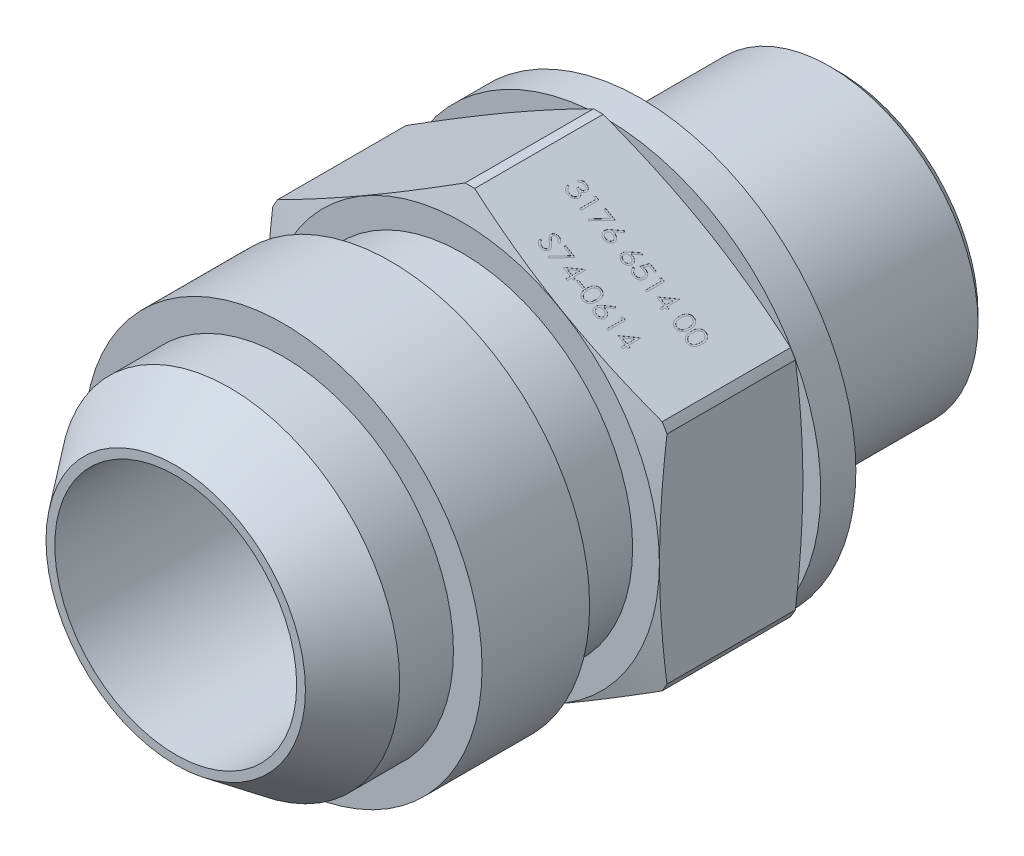
from build123d import *

# Parameters (mm, degrees)
SKETCH2_OUTSIDE_W  = 37.354
SKETCH2_OUTSIDE_H  = 37.354
EXTRUDE2_DEPTH     = 8
SKETCH3_R          = 12
EXTRUDE3_DEPTH     = 1.96
SKETCH4_R          = 4.7
EXTRUDE4_DEPTH     = 32.231780289
SKETCH5_W          = 0.384615385
SKETCH5_H          = 0.102564102
CUT_EXTRUDE1_DEPTH = 0.01


with BuildPart() as part:
    # Sketch1 → Revolve1 (revolve)
    with BuildSketch(Plane(origin=(0, 0, 0), x_dir=(0, 0, -1), z_dir=(1, 0, 0)), mode=Mode.PRIVATE) as revolve1_sk:
        Polygon((0, 7.23933785), (3, 9.5), (6, 9.5), (6, 11.1), (12, 11.1), (12, 9.5), (16, 9.5), (16, 10.99402544), (16.416922127, 12.55), (23.583077873, 12.55), (24, 10.99402544), (24, 8.275), (36.5, 8.275), (37, 7.775), (37, 6.8), (33.362693304, 4.7), (11.231764269, 4.7), (10, 6.75), (0, 6.75), align=None)
    revolve(revolve1_sk.sketch.rotate(Axis((0, 0, 0), (0, 0, -1)), 90), axis=Axis((0, 0, 0), (0, 0, -1)))

    # Sketch2 outside → Extrude2 (cut)
    with BuildSketch(Plane.XY.offset(-16)):
        Rectangle(SKETCH2_OUTSIDE_W, SKETCH2_OUTSIDE_H)
        Polygon((0, 12.701705922), (-11, 6.350852961), (-11, -6.350852961), (0, -12.701705922), (11, -6.350852961), (11, 6.350852961), align=None, mode=Mode.SUBTRACT)
    extrude(amount=-EXTRUDE2_DEPTH, mode=Mode.SUBTRACT)

    # Sketch3 → Extrude3 (add)
    with BuildSketch(Plane(origin=(0, 0, -24), x_dir=(-1, 0, 0), z_dir=(0, 0, -1))):
        Circle(SKETCH3_R)
    extrude(amount=EXTRUDE3_DEPTH)

    # Sketch4 → Extrude4 (cut, through all)
    with BuildSketch(Plane(origin=(0, 0, -25.96), x_dir=(-1, 0, 0), z_dir=(0, 0, -1))):
        with Locations(Location((0, 0, 0), (0, 0, 180))):
            Circle(SKETCH4_R)
    extrude(amount=-EXTRUDE4_DEPTH, mode=Mode.SUBTRACT)

    # Sketch5 → Cut-Extrude1 (cut)
    # profile 1 of 18: a face of its own
    with BuildSketch(Plane(origin=(5.5, 9.526279442, 0), x_dir=(0.8660254037844385, -0.5000000000000003, 0), z_dir=(0.5000000000000003, 0.8660254037844385, 0))):
        with BuildLine():
            Line((-4.131706091, 20.569230769), (-4.221449681, 20.569230769))
            add(Edge.make_bspline(
                [(-4.221449681, 20.569230769), (-4.219018381, 20.579297193), (-4.214265388, 20.598976229), (-4.204351795, 20.627092589), (-4.193552008, 20.653699309), (-4.180583693, 20.678298188), (-4.166438334, 20.701383588), (-4.150231842, 20.72243191), (-4.132711922, 20.741978471), (-4.113333365, 20.759325111), (-4.09301089, 20.775033033), (-4.071458141, 20.788425907), (-4.049108743, 20.799947093), (-4.025807848, 20.809438588), (-4.001486085, 20.816588738), (-3.976363335, 20.821776396), (-3.950373764, 20.825145286), (-3.932731595, 20.825474076), (-3.923773399, 20.825641026)],
                knots=[0, 0, 0, 0, 1.162005537, 2.271625781, 3.343758855, 4.383309926, 5.390229558, 6.379919256, 7.361854164, 8.333198761, 9.295911338, 10.242430842, 11.177959212, 12.116337295, 13.062827104, 14.020064771, 14.994644689, 16, 16, 16, 16], degree=3))
            add(Edge.make_bspline(
                [(-3.923773399, 20.825641026), (-3.910721187, 20.82524696), (-3.88490147, 20.824467424), (-3.84696917, 20.817349014), (-3.810390079, 20.80608469), (-3.77556458, 20.790520768), (-3.743216456, 20.771324393), (-3.714434689, 20.748477325), (-3.6896094, 20.722420382), (-3.668782435, 20.693639649), (-3.652475292, 20.662880932), (-3.640450614, 20.631223744), (-3.633130134, 20.598743181), (-3.632181403, 20.57681253), (-3.631706091, 20.565825321)],
                knots=[0, 0, 0, 0, 1.083050992, 2.142477498, 3.193116406, 4.255571735, 5.30263384, 6.308962982, 7.297363603, 8.282367274, 9.249857812, 10.179914175, 11.08814088, 12, 12, 12, 12], degree=3))
            add(Edge.make_bspline(
                [(-3.631706091, 20.565825321), (-3.632038546, 20.555251951), (-3.632689108, 20.534561506), (-3.638213024, 20.504355364), (-3.647509099, 20.475886336), (-3.660386174, 20.449034575), (-3.677055188, 20.423970335), (-3.697247387, 20.400637224), (-3.721105291, 20.37893175), (-3.739184987, 20.366497615), (-3.74849295, 20.360096154)],
                knots=[0, 0, 0, 0, 1.024540389, 2.004866551, 2.965041327, 3.920577974, 4.882998113, 5.874504559, 6.905732034, 8, 8, 8, 8], degree=3))
            add(Edge.make_bspline(
                [(-3.74849295, 20.360096154), (-3.737855306, 20.354959533), (-3.716779056, 20.344782403), (-3.688050334, 20.324823615), (-3.661970941, 20.301778944), (-3.647427021, 20.283795329), (-3.640119553, 20.274759615)],
                knots=[0, 0, 0, 0, 1.015518401, 2.012035669, 3.001164323, 4, 4, 4, 4], degree=3))
            add(Edge.make_bspline(
                [(-3.640119553, 20.274759615), (-3.635307741, 20.268171686), (-3.625762913, 20.25510371), (-3.613981332, 20.234093303), (-3.603293014, 20.21285002), (-3.59496438, 20.190804476), (-3.588514704, 20.168212186), (-3.583904409, 20.145034358), (-3.581040368, 20.121252066), (-3.580630211, 20.105162786), (-3.58042404, 20.097075321)],
                knots=[0, 0, 0, 0, 1.025084078, 2.033381695, 3.024893161, 4.013698104, 4.991890475, 5.976764909, 6.982997093, 8, 8, 8, 8], degree=3))
            add(Edge.make_bspline(
                [(-3.58042404, 20.097075321), (-3.580936758, 20.083072543), (-3.581959782, 20.055132885), (-3.591103803, 20.013854393), (-3.605279014, 19.97350425), (-3.625409568, 19.934911439), (-3.649943142, 19.898802758), (-3.679130948, 19.866495242), (-3.712641351, 19.838724212), (-3.750014393, 19.815521289), (-3.790505002, 19.796973312), (-3.833812314, 19.784099757), (-3.879312329, 19.775715185), (-3.910514414, 19.77481608), (-3.926377566, 19.774358974)],
                knots=[0, 0, 0, 0, 0.955779014, 1.907060117, 2.875433937, 3.871313158, 4.872415639, 5.851225146, 6.836215519, 7.83643374, 8.849228613, 9.86973379, 10.916971861, 12, 12, 12, 12], degree=3))
            add(Edge.make_bspline(
                [(-3.926377566, 19.774358974), (-3.937068794, 19.774607035), (-3.958105567, 19.775095136), (-3.989032281, 19.77843188), (-4.018552767, 19.784526167), (-4.046706937, 19.792727111), (-4.073519805, 19.803124752), (-4.098909549, 19.816072951), (-4.123032376, 19.831304809), (-4.145660648, 19.84900012), (-4.166791667, 19.868794788), (-4.185863874, 19.89104022), (-4.203195243, 19.915325192), (-4.218321712, 19.94193178), (-4.231932269, 19.970516139), (-4.243126829, 20.001444281), (-4.252979848, 20.034439716), (-4.257560838, 20.057433356), (-4.25991122, 20.069230769)],
                knots=[0, 0, 0, 0, 1.048658725, 2.063410685, 3.046034179, 4.001477787, 4.936774919, 5.862367409, 6.792675028, 7.730719943, 8.675894397, 9.627829632, 10.600096036, 11.597688215, 12.626045268, 13.701542398, 14.82072376, 16, 16, 16, 16], degree=3))
            Line((-4.25991122, 20.069230769), (-4.17016763, 20.069230769))
            add(Edge.make_bspline(
                [(-4.17016763, 20.069230769), (-4.167829546, 20.061531051), (-4.163281771, 20.046554431), (-4.155540543, 20.025000058), (-4.146721037, 20.005240614), (-4.137259735, 19.98713115), (-4.127323036, 19.970493321), (-4.116204486, 19.955767073), (-4.104727587, 19.942305587), (-4.096076343, 19.934721412), (-4.091842309, 19.931009615)],
                knots=[0, 0, 0, 0, 1.198163088, 2.33053128, 3.407730985, 4.417276592, 5.372219308, 6.28897303, 7.162600585, 8, 8, 8, 8], degree=3))
            add(Edge.make_bspline(
                [(-4.091842309, 19.931009615), (-4.086243287, 19.926692949), (-4.075062527, 19.918072939), (-4.056843032, 19.907072474), (-4.037681636, 19.897540753), (-4.017163158, 19.890259697), (-3.995730366, 19.884094651), (-3.973036833, 19.880060217), (-3.949282771, 19.877292168), (-3.93306341, 19.877047902), (-3.924775002, 19.876923077)],
                knots=[0, 0, 0, 0, 0.946170439, 1.889420265, 2.845303464, 3.807233317, 4.801018734, 5.828864929, 6.890507805, 8, 8, 8, 8], degree=3))
            add(Edge.make_bspline(
                [(-3.924775002, 19.876923077), (-3.915416858, 19.87709905), (-3.897117816, 19.87744315), (-3.870416428, 19.880607637), (-3.8450143, 19.885216327), (-3.821193464, 19.892334322), (-3.79864189, 19.901128851), (-3.777675705, 19.912171253), (-3.758019674, 19.925126887), (-3.739925558, 19.939852361), (-3.723655413, 19.955972788), (-3.709329838, 19.972833666), (-3.697151364, 19.990363903), (-3.687327484, 20.008660509), (-3.679570184, 20.027647717), (-3.67428927, 20.047378811), (-3.670617408, 20.067692316), (-3.670318376, 20.081500593), (-3.67016763, 20.088461538)],
                knots=[0, 0, 0, 0, 1.217147791, 2.380027433, 3.494444702, 4.572153297, 5.609568379, 6.639424714, 7.649109417, 8.668170816, 9.669597737, 10.625200337, 11.543417969, 12.441394052, 13.322311151, 14.205496177, 15.095365482, 16, 16, 16, 16], degree=3))
            add(Edge.make_bspline(
                [(-3.67016763, 20.088461538), (-3.670604859, 20.097779064), (-3.671477141, 20.116367752), (-3.678136735, 20.14371563), (-3.689090697, 20.170065177), (-3.7044257, 20.194966831), (-3.723093051, 20.21804566), (-3.744911596, 20.238637512), (-3.770062518, 20.255628967), (-3.793211052, 20.267368583), (-3.813715382, 20.275379176), (-3.831262635, 20.28071488), (-3.850907379, 20.285233067), (-3.87241205, 20.289436573), (-3.895938683, 20.293014101), (-3.921461666, 20.295997477), (-3.948986169, 20.298384632), (-3.968040788, 20.299450659), (-3.977859937, 20.3)],
                knots=[0, 0, 0, 0, 1.07054697, 2.135767047, 3.216561865, 4.33974944, 5.486079747, 6.621378074, 7.775625952, 8.963672916, 9.598146892, 10.304877434, 11.070270905, 11.915000392, 12.823868403, 13.805723172, 14.86925407, 16, 16, 16, 16], degree=3))
            Line((-3.977859937, 20.3), (-3.977859937, 20.402564103))
            add(Edge.make_bspline(
                [(-3.977859937, 20.402564103), (-3.965488176, 20.402774046), (-3.941254934, 20.403185275), (-3.905856561, 20.408158992), (-3.872007043, 20.415039172), (-3.840456546, 20.425577798), (-3.81169977, 20.437817883), (-3.786751313, 20.452061371), (-3.765960699, 20.467894157), (-3.749428964, 20.485560617), (-3.736992042, 20.504507773), (-3.727898671, 20.52425539), (-3.72252715, 20.54497655), (-3.721810102, 20.559117884), (-3.721449681, 20.566225962)],
                knots=[0, 0, 0, 0, 1.321986639, 2.589447074, 3.816329219, 5.01088745, 6.139805852, 7.153945165, 8.075214402, 8.924034688, 9.728124013, 10.488707548, 11.240355623, 12, 12, 12, 12], degree=3))
            add(Edge.make_bspline(
                [(-3.721449681, 20.566225962), (-3.721568084, 20.571448174), (-3.721803642, 20.581837519), (-3.724774292, 20.59701611), (-3.729238304, 20.611730666), (-3.73537537, 20.625918612), (-3.743589712, 20.639481548), (-3.753419994, 20.652535104), (-3.765125165, 20.665004756), (-3.77853815, 20.676627704), (-3.792941523, 20.687704629), (-3.808727173, 20.697108525), (-3.825419137, 20.705149971), (-3.843035896, 20.711781258), (-3.861634619, 20.716769626), (-3.881127921, 20.720351295), (-3.901552973, 20.722590625), (-3.915487754, 20.722913029), (-3.922571476, 20.723076923)],
                knots=[0, 0, 0, 0, 0.884392785, 1.759457502, 2.611959086, 3.489218968, 4.37281399, 5.2945488, 6.255912374, 7.266815255, 8.301784654, 9.332968512, 10.37626691, 11.440494194, 12.520033166, 13.637162961, 14.798855837, 16, 16, 16, 16], degree=3))
            add(Edge.make_bspline(
                [(-3.922571476, 20.723076923), (-3.933957667, 20.722679391), (-3.956197546, 20.721902919), (-3.988258951, 20.715102058), (-4.018064475, 20.704251177), (-4.040846951, 20.691298885), (-4.057670543, 20.678513047), (-4.069692526, 20.667346651), (-4.081498386, 20.654937273), (-4.092311436, 20.640520594), (-4.103246858, 20.62507294), (-4.113202447, 20.607809031), (-4.122876645, 20.589179204), (-4.128705945, 20.576009023), (-4.131706091, 20.569230769)],
                knots=[0, 0, 0, 0, 1.472543308, 2.876219568, 4.221790263, 5.565193594, 6.249813518, 6.953379497, 7.687249741, 8.463570142, 9.283606569, 10.136032583, 11.040678096, 12, 12, 12, 12], degree=3))
        make_face()
    # profile 2 of 18: a face of its own
    with BuildSketch(Plane(origin=(5.5, 9.526279442, 0), x_dir=(0.8660254037844385, -0.5000000000000003, 0), z_dir=(0.5000000000000003, 0.8660254037844385, 0))):
        Polygon((-3.278140386, 20.8), (-3.093244553, 20.8), (-3.093244553, 19.8), (-3.182988143, 19.8), (-3.182988143, 20.697435897), (-3.336834296, 20.697435897), align=None)
    # profile 3 of 18: a face of its own
    with BuildSketch(Plane(origin=(5.5, 9.526279442, 0), x_dir=(0.8660254037844385, -0.5000000000000003, 0), z_dir=(0.5000000000000003, 0.8660254037844385, 0))):
        Polygon((-2.657347117, 20.8), (-2.041962502, 20.8), (-2.567603527, 19.774358974), (-2.645127566, 19.817027244), (-2.194005771, 20.697435897), (-2.657347117, 20.697435897), align=None)
    # profile 4 of 18: a face of its own
    with BuildSketch(Plane(origin=(5.5, 9.526279442, 0), x_dir=(0.8660254037844385, -0.5000000000000003, 0), z_dir=(0.5000000000000003, 0.8660254037844385, 0))):
        with BuildLine():
            Line((-1.49068045, 20.825641026), (-1.421369553, 20.771354167))
            Line((-1.421369553, 20.771354167), (-1.685592309, 20.367307692))
            add(Edge.make_bspline(
                [(-1.685592309, 20.367307692), (-1.668000802, 20.370111652), (-1.633686577, 20.375581094), (-1.598953463, 20.376483364), (-1.582026604, 20.376923077)],
                knots=[0, 0, 0, 0, 1.025318673, 2, 2, 2, 2], degree=3))
            add(Edge.make_bspline(
                [(-1.582026604, 20.376923077), (-1.571862522, 20.376653859), (-1.551921005, 20.376125663), (-1.522619739, 20.371951498), (-1.494457626, 20.365454432), (-1.467497494, 20.355945581), (-1.441705126, 20.343802715), (-1.416933037, 20.329248572), (-1.393646742, 20.311532713), (-1.371546407, 20.291742712), (-1.351481521, 20.269823577), (-1.333716934, 20.246566051), (-1.318794993, 20.221994371), (-1.306688159, 20.196120981), (-1.297286765, 20.168985764), (-1.290433152, 20.140623438), (-1.28638184, 20.111014446), (-1.2858317, 20.090877825), (-1.285552245, 20.080649038)],
                knots=[0, 0, 0, 0, 1.044136307, 2.048553127, 3.035567123, 4.010001674, 4.980053131, 5.96154148, 6.956538004, 7.981742224, 9.006487041, 10.005615874, 10.984750588, 11.954802044, 12.935714515, 13.930994945, 14.949008866, 16, 16, 16, 16], degree=3))
            add(Edge.make_bspline(
                [(-1.285552245, 20.080649038), (-1.285958847, 20.066654837), (-1.286758942, 20.039117561), (-1.294731455, 19.999009931), (-1.307119925, 19.960800641), (-1.32482779, 19.925099735), (-1.346822757, 19.891956143), (-1.373644926, 19.862588868), (-1.404343066, 19.836397428), (-1.439053579, 19.814495537), (-1.476408712, 19.796608951), (-1.51565214, 19.783761739), (-1.556402753, 19.775852176), (-1.584061213, 19.774860576), (-1.598052245, 19.774358974)],
                knots=[0, 0, 0, 0, 1.031375318, 2.029502543, 3.004789286, 3.987476834, 4.960371455, 5.9300674, 6.912260825, 7.929083631, 8.949397511, 9.960523116, 10.96833055, 12, 12, 12, 12], degree=3))
            add(Edge.make_bspline(
                [(-1.598052245, 19.774358974), (-1.611508445, 19.774795605), (-1.638162822, 19.775660493), (-1.677372192, 19.783365046), (-1.71504734, 19.79585279), (-1.750924305, 19.813056869), (-1.784158766, 19.834787693), (-1.813891805, 19.860948344), (-1.839975169, 19.89097962), (-1.861682204, 19.924876862), (-1.878898985, 19.961302564), (-1.891810392, 19.999284609), (-1.899352176, 20.038684604), (-1.900406049, 20.065393501), (-1.900936861, 20.078846154)],
                knots=[0, 0, 0, 0, 1.012016664, 2.004627821, 2.994792927, 3.992885782, 4.990978636, 5.973936114, 6.964471063, 7.975201453, 8.993600317, 9.990122807, 10.98767138, 12, 12, 12, 12], degree=3))
            add(Edge.make_bspline(
                [(-1.900936861, 20.078846154), (-1.900599305, 20.089144606), (-1.899910081, 20.110172078), (-1.895097683, 20.142018943), (-1.887364885, 20.174604967), (-1.878704814, 20.202249022), (-1.86955464, 20.224895171), (-1.861939629, 20.243153311), (-1.852461344, 20.261942189), (-1.842354664, 20.281906085), (-1.830709844, 20.302530495), (-1.81804823, 20.324160115), (-1.804019758, 20.346450951), (-1.794185426, 20.361577864), (-1.789158014, 20.369310897)],
                knots=[0, 0, 0, 0, 1.173818275, 2.396712641, 3.66331629, 4.989737886, 5.693666774, 6.447286557, 7.243889047, 8.091586357, 8.998013824, 9.943181721, 10.948533338, 12, 12, 12, 12], degree=3))
            Line((-1.789158014, 20.369310897), (-1.49068045, 20.825641026))
        make_face()
        with BuildLine():
            add(Edge.make_bspline(
                [(-1.600856732, 20.274358974), (-1.608474273, 20.274133726), (-1.623419825, 20.273691791), (-1.645319527, 20.271195869), (-1.665989916, 20.266466384), (-1.685668449, 20.260349948), (-1.704145082, 20.252017338), (-1.721648866, 20.242032504), (-1.737978343, 20.230069796), (-1.7530538, 20.216565249), (-1.766715007, 20.201766021), (-1.778481449, 20.185918275), (-1.788630601, 20.169399753), (-1.796882577, 20.152073531), (-1.803308305, 20.133945947), (-1.807956379, 20.115100451), (-1.810543165, 20.095410648), (-1.810973516, 20.082058504), (-1.811193271, 20.075240385)],
                knots=[0, 0, 0, 0, 1.128956033, 2.215002439, 3.259141796, 4.2666399, 5.263148119, 6.255916712, 7.247353359, 8.256307737, 9.250603402, 10.226115518, 11.176314381, 12.118911324, 13.063945463, 14.021379252, 14.989639887, 16, 16, 16, 16], degree=3))
            add(Edge.make_bspline(
                [(-1.811193271, 20.075240385), (-1.81101431, 20.068483248), (-1.810663396, 20.055233508), (-1.807477019, 20.035708028), (-1.802609852, 20.016918054), (-1.795369739, 19.998960454), (-1.786733485, 19.981561506), (-1.775331964, 19.965351425), (-1.762698597, 19.94934569), (-1.747597473, 19.934773841), (-1.731390798, 19.921214806), (-1.714076168, 19.909363305), (-1.696030466, 19.899224398), (-1.677010059, 19.89127837), (-1.657284807, 19.884757145), (-1.636690363, 19.880168151), (-1.615212404, 19.877573715), (-1.600663279, 19.877142803), (-1.593244553, 19.876923077)],
                knots=[0, 0, 0, 0, 0.989467248, 1.94019797, 2.891935182, 3.827694429, 4.772920941, 5.730924762, 6.725747692, 7.756678648, 8.79901574, 9.819492441, 10.826891316, 11.826466727, 12.835195252, 13.867842842, 14.912794438, 16, 16, 16, 16], degree=3))
            add(Edge.make_bspline(
                [(-1.593244553, 19.876923077), (-1.585825839, 19.87714282), (-1.571276738, 19.877573766), (-1.549798606, 19.880167958), (-1.529204801, 19.884757857), (-1.509477227, 19.891275791), (-1.49046539, 19.899233965), (-1.472435469, 19.909300228), (-1.455284585, 19.92128769), (-1.439067271, 19.93475067), (-1.424029003, 19.949428628), (-1.411092638, 19.965208548), (-1.400040285, 19.981692518), (-1.391059089, 19.998891916), (-1.38389872, 20.016928912), (-1.379006872, 20.035705119), (-1.375827075, 20.055234269), (-1.375475256, 20.068483505), (-1.375295835, 20.075240385)],
                knots=[0, 0, 0, 0, 1.087397944, 2.132534446, 3.165364764, 4.174271784, 5.174024072, 6.181601208, 7.194203697, 8.236725232, 9.267838612, 10.269026844, 11.221737037, 12.171628256, 13.107553087, 14.05945871, 15.010357665, 16, 16, 16, 16], degree=3))
            add(Edge.make_bspline(
                [(-1.375295835, 20.075240385), (-1.375453062, 20.082067399), (-1.375761647, 20.095466608), (-1.379251915, 20.115091646), (-1.384092604, 20.134041688), (-1.391402002, 20.152197735), (-1.400898307, 20.169487765), (-1.412464416, 20.186000557), (-1.42584742, 20.201857104), (-1.441295014, 20.216603181), (-1.458110902, 20.229986534), (-1.475876938, 20.242077413), (-1.494703693, 20.251924395), (-1.514251481, 20.26037829), (-1.53475575, 20.266369431), (-1.555992537, 20.271210635), (-1.578163071, 20.273670926), (-1.59323987, 20.274128039), (-1.600856732, 20.274358974)],
                knots=[0, 0, 0, 0, 0.978753431, 1.920974676, 2.853199117, 3.782215702, 4.721507756, 5.67862441, 6.671401678, 7.694929396, 8.738190014, 9.75360867, 10.774035531, 11.783329636, 12.805060902, 13.835252836, 14.906360638, 16, 16, 16, 16], degree=3))
        make_face(mode=Mode.SUBTRACT)
    # profile 5 of 18: a face of its own
    with BuildSketch(Plane(origin=(5.5, 9.526279442, 0), x_dir=(0.8660254037844385, -0.5000000000000003, 0), z_dir=(0.5000000000000003, 0.8660254037844385, 0))):
        with BuildLine():
            Line((-0.336834296, 20.825641026), (-0.267523399, 20.771354167))
            Line((-0.267523399, 20.771354167), (-0.531746155, 20.367307692))
            add(Edge.make_bspline(
                [(-0.531746155, 20.367307692), (-0.514154648, 20.370111652), (-0.479840423, 20.375581094), (-0.445107309, 20.376483364), (-0.42818045, 20.376923077)],
                knots=[0, 0, 0, 0, 1.025318673, 2, 2, 2, 2], degree=3))
            add(Edge.make_bspline(
                [(-0.42818045, 20.376923077), (-0.418016368, 20.376653859), (-0.398074852, 20.376125663), (-0.368773585, 20.371951498), (-0.340611473, 20.365454432), (-0.31365134, 20.355945581), (-0.287858972, 20.343802715), (-0.263086883, 20.329248572), (-0.239800588, 20.311532713), (-0.217700253, 20.291742712), (-0.197635367, 20.269823577), (-0.17987078, 20.246566051), (-0.16494884, 20.221994371), (-0.152842005, 20.196120981), (-0.143440611, 20.168985764), (-0.136586998, 20.140623438), (-0.132535686, 20.111014446), (-0.131985546, 20.090877825), (-0.131706091, 20.080649038)],
                knots=[0, 0, 0, 0, 1.044136307, 2.048553127, 3.035567123, 4.010001674, 4.980053131, 5.96154148, 6.956538004, 7.981742224, 9.006487041, 10.005615874, 10.984750588, 11.954802044, 12.935714515, 13.930994945, 14.949008866, 16, 16, 16, 16], degree=3))
            add(Edge.make_bspline(
                [(-0.131706091, 20.080649038), (-0.132112693, 20.066654837), (-0.132912788, 20.039117561), (-0.140885301, 19.999009931), (-0.153273771, 19.960800641), (-0.170981636, 19.925099735), (-0.192976603, 19.891956143), (-0.219798772, 19.862588868), (-0.250496912, 19.836397428), (-0.285207426, 19.814495537), (-0.322562558, 19.796608951), (-0.361805986, 19.783761739), (-0.402556599, 19.775852176), (-0.430215059, 19.774860576), (-0.444206091, 19.774358974)],
                knots=[0, 0, 0, 0, 1.031375318, 2.029502543, 3.004789286, 3.987476834, 4.960371455, 5.9300674, 6.912260825, 7.929083631, 8.949397511, 9.960523116, 10.96833055, 12, 12, 12, 12], degree=3))
            add(Edge.make_bspline(
                [(-0.444206091, 19.774358974), (-0.457662291, 19.774795605), (-0.484316668, 19.775660493), (-0.523526038, 19.783365046), (-0.561201186, 19.79585279), (-0.597078152, 19.813056869), (-0.630312612, 19.834787693), (-0.660045651, 19.860948344), (-0.686129016, 19.89097962), (-0.70783605, 19.924876862), (-0.725052831, 19.961302564), (-0.737964238, 19.999284609), (-0.745506022, 20.038684604), (-0.746559895, 20.065393501), (-0.747090707, 20.078846154)],
                knots=[0, 0, 0, 0, 1.012016664, 2.004627821, 2.994792927, 3.992885782, 4.990978636, 5.973936114, 6.964471063, 7.975201453, 8.993600317, 9.990122807, 10.98767138, 12, 12, 12, 12], degree=3))
            add(Edge.make_bspline(
                [(-0.747090707, 20.078846154), (-0.746753151, 20.089144606), (-0.746063927, 20.110172078), (-0.741251529, 20.142018943), (-0.733518731, 20.174604967), (-0.724858661, 20.202249022), (-0.715708486, 20.224895171), (-0.708093475, 20.243153311), (-0.69861519, 20.261942189), (-0.68850851, 20.281906085), (-0.67686369, 20.302530495), (-0.664202076, 20.324160115), (-0.650173605, 20.346450951), (-0.640339272, 20.361577864), (-0.635311861, 20.369310897)],
                knots=[0, 0, 0, 0, 1.173818275, 2.396712641, 3.66331629, 4.989737886, 5.693666774, 6.447286557, 7.243889047, 8.091586357, 8.998013824, 9.943181721, 10.948533338, 12, 12, 12, 12], degree=3))
            Line((-0.635311861, 20.369310897), (-0.336834296, 20.825641026))
        make_face()
        with BuildLine():
            add(Edge.make_bspline(
                [(-0.447010578, 20.274358974), (-0.454628119, 20.274133726), (-0.469573671, 20.273691791), (-0.491473374, 20.271195869), (-0.512143763, 20.266466384), (-0.531822295, 20.260349948), (-0.550298928, 20.252017338), (-0.567802712, 20.242032504), (-0.584132189, 20.230069796), (-0.599207646, 20.216565249), (-0.612868853, 20.201766021), (-0.624635295, 20.185918275), (-0.634784447, 20.169399753), (-0.643036423, 20.152073531), (-0.649462151, 20.133945947), (-0.654110225, 20.115100451), (-0.656697011, 20.095410648), (-0.657127363, 20.082058504), (-0.657347117, 20.075240385)],
                knots=[0, 0, 0, 0, 1.128956033, 2.215002439, 3.259141796, 4.2666399, 5.263148119, 6.255916712, 7.247353359, 8.256307737, 9.250603402, 10.226115518, 11.176314381, 12.118911324, 13.063945463, 14.021379252, 14.989639887, 16, 16, 16, 16], degree=3))
            add(Edge.make_bspline(
                [(-0.657347117, 20.075240385), (-0.657168157, 20.068483248), (-0.656817242, 20.055233508), (-0.653630865, 20.035708028), (-0.648763698, 20.016918054), (-0.641523585, 19.998960454), (-0.632887331, 19.981561506), (-0.62148581, 19.965351425), (-0.608852443, 19.94934569), (-0.593751319, 19.934773841), (-0.577544644, 19.921214806), (-0.560230015, 19.909363305), (-0.542184312, 19.899224398), (-0.523163905, 19.89127837), (-0.503438653, 19.884757145), (-0.482844209, 19.880168151), (-0.46136625, 19.877573715), (-0.446817125, 19.877142803), (-0.439398399, 19.876923077)],
                knots=[0, 0, 0, 0, 0.989467248, 1.94019797, 2.891935182, 3.827694429, 4.772920941, 5.730924762, 6.725747692, 7.756678648, 8.79901574, 9.819492441, 10.826891316, 11.826466727, 12.835195252, 13.867842842, 14.912794438, 16, 16, 16, 16], degree=3))
            add(Edge.make_bspline(
                [(-0.439398399, 19.876923077), (-0.431979685, 19.87714282), (-0.417430584, 19.877573766), (-0.395952452, 19.880167958), (-0.375358647, 19.884757857), (-0.355631073, 19.891275791), (-0.336619236, 19.899233965), (-0.318589315, 19.909300228), (-0.301438431, 19.92128769), (-0.285221117, 19.93475067), (-0.270182849, 19.949428628), (-0.257246484, 19.965208548), (-0.246194131, 19.981692518), (-0.237212935, 19.998891916), (-0.230052566, 20.016928912), (-0.225160718, 20.035705119), (-0.221980922, 20.055234269), (-0.221629103, 20.068483505), (-0.221449681, 20.075240385)],
                knots=[0, 0, 0, 0, 1.087397944, 2.132534446, 3.165364764, 4.174271784, 5.174024072, 6.181601208, 7.194203697, 8.236725232, 9.267838612, 10.269026844, 11.221737037, 12.171628256, 13.107553087, 14.05945871, 15.010357665, 16, 16, 16, 16], degree=3))
            add(Edge.make_bspline(
                [(-0.221449681, 20.075240385), (-0.221606908, 20.082067399), (-0.221915493, 20.095466608), (-0.225405761, 20.115091646), (-0.23024645, 20.134041688), (-0.237555848, 20.152197735), (-0.247052153, 20.169487765), (-0.258618262, 20.186000557), (-0.272001267, 20.201857104), (-0.28744886, 20.216603181), (-0.304264748, 20.229986534), (-0.322030784, 20.242077413), (-0.340857539, 20.251924395), (-0.360405327, 20.26037829), (-0.380909597, 20.266369431), (-0.402146383, 20.271210635), (-0.424316917, 20.273670926), (-0.439393716, 20.274128039), (-0.447010578, 20.274358974)],
                knots=[0, 0, 0, 0, 0.978753431, 1.920974676, 2.853199117, 3.782215702, 4.721507756, 5.67862441, 6.671401678, 7.694929396, 8.738190014, 9.75360867, 10.774035531, 11.783329636, 12.805060902, 13.835252836, 14.906360638, 16, 16, 16, 16], degree=3))
        make_face(mode=Mode.SUBTRACT)
    # profile 6 of 18: a face of its own
    with BuildSketch(Plane(origin=(5.5, 9.526279442, 0), x_dir=(0.8660254037844385, -0.5000000000000003, 0), z_dir=(0.5000000000000003, 0.8660254037844385, 0))):
        with BuildLine():
            Line((0.599063139, 20.8), (0.599063139, 20.697435897))
            Line((0.599063139, 20.697435897), (0.259119229, 20.697435897))
            Line((0.259119229, 20.697435897), (0.205032691, 20.434415064))
            add(Edge.make_bspline(
                [(0.205032691, 20.434415064), (0.215620083, 20.437337999), (0.236131482, 20.443000723), (0.266405728, 20.449288086), (0.295146358, 20.453078213), (0.313796464, 20.45359573), (0.322821152, 20.453846154)],
                knots=[0, 0, 0, 0, 1.100273476, 2.13160584, 3.095893838, 4, 4, 4, 4], degree=3))
            add(Edge.make_bspline(
                [(0.322821152, 20.453846154), (0.333987935, 20.453604458), (0.35594462, 20.453129223), (0.388070033, 20.448565838), (0.418736574, 20.441383005), (0.447880109, 20.43134857), (0.475554552, 20.418517218), (0.501505284, 20.402488664), (0.52612183, 20.383764855), (0.548962571, 20.362237708), (0.569683802, 20.338545818), (0.587902656, 20.31307214), (0.603377682, 20.286064237), (0.615823612, 20.257264063), (0.625761993, 20.226990019), (0.632376849, 20.194923567), (0.636781623, 20.161366961), (0.637273733, 20.138422798), (0.637524678, 20.126722756)],
                knots=[0, 0, 0, 0, 1.052922333, 2.070308379, 3.05430497, 4.020497103, 4.973039431, 5.925935799, 6.892292201, 7.88610001, 8.88166317, 9.857072816, 10.836096531, 11.812156883, 12.81219415, 13.836441305, 14.89672472, 16, 16, 16, 16], degree=3))
            add(Edge.make_bspline(
                [(0.637524678, 20.126722756), (0.637334656, 20.118573551), (0.636957181, 20.102385268), (0.635037585, 20.078344068), (0.631341666, 20.05481183), (0.626379459, 20.031785433), (0.619938768, 20.009308469), (0.612141896, 19.987316604), (0.602600174, 19.965946716), (0.592134066, 19.944996603), (0.580349358, 19.924939887), (0.567269785, 19.906183034), (0.553451073, 19.888444668), (0.538582106, 19.87191503), (0.522524679, 19.856702739), (0.50547326, 19.842717516), (0.487563911, 19.82972285), (0.468519556, 19.818246223), (0.448764561, 19.807685378), (0.428013642, 19.79902151), (0.406739156, 19.791275645), (0.384634906, 19.785101494), (0.361750959, 19.780263621), (0.338049595, 19.776977736), (0.313655118, 19.774584468), (0.2971194, 19.774434651), (0.288766665, 19.774358974)],
                knots=[0, 0, 0, 0, 1.056347294, 2.098418968, 3.122841568, 4.141288669, 5.149314143, 6.15115421, 7.162517403, 8.180376062, 9.185164535, 10.17417709, 11.141909838, 12.097768115, 13.052685741, 14.0056014, 14.954263652, 15.917497458, 16.885230207, 17.854509472, 18.828990115, 19.81800267, 20.826176721, 21.857883937, 22.917946725, 24, 24, 24, 24], degree=3))
            add(Edge.make_bspline(
                [(0.288766665, 19.774358974), (0.278802613, 19.774556357), (0.259199519, 19.774944683), (0.230479357, 19.779007107), (0.202846612, 19.784825369), (0.176523726, 19.793578589), (0.151274794, 19.804546388), (0.127439732, 19.818408151), (0.10440951, 19.834116466), (0.083120357, 19.85265371), (0.063361467, 19.872915333), (0.045673893, 19.894903231), (0.029921443, 19.9182545), (0.016356372, 19.943082544), (0.004785509, 19.969322124), (-0.004304488, 19.997071553), (-0.011641161, 20.02618584), (-0.014744995, 20.0462297), (-0.016321476, 20.056410256)],
                knots=[0, 0, 0, 0, 1.0467383, 2.05933395, 3.04377827, 4.011590433, 4.970194871, 5.932262533, 6.905835911, 7.896367577, 8.894135286, 9.877477877, 10.858688626, 11.851381753, 12.8477658, 13.868841284, 14.917554742, 16, 16, 16, 16], degree=3))
            Line((-0.016321476, 20.056410256), (0.073422114, 20.056410256))
            add(Edge.make_bspline(
                [(0.073422114, 20.056410256), (0.075630273, 20.046874127), (0.079874478, 20.028545157), (0.089190406, 20.002793345), (0.100580656, 19.979844996), (0.114124756, 19.959396543), (0.130281907, 19.941565401), (0.148718887, 19.925674812), (0.169389665, 19.911339061), (0.192359159, 19.899389699), (0.216591468, 19.889198626), (0.241953528, 19.882412428), (0.267754769, 19.877640744), (0.285205732, 19.877163098), (0.293974998, 19.876923077)],
                knots=[0, 0, 0, 0, 1.136247022, 2.183929868, 3.172523383, 4.106158343, 5.02341133, 5.958108904, 6.928429099, 7.938127109, 8.96079061, 9.975095812, 10.982467395, 12, 12, 12, 12], degree=3))
            add(Edge.make_bspline(
                [(0.293974998, 19.876923077), (0.302534554, 19.877157585), (0.319388389, 19.877619333), (0.344191642, 19.881173336), (0.368138178, 19.886646928), (0.390991708, 19.894838315), (0.413152148, 19.904793949), (0.43405894, 19.917569685), (0.454316905, 19.932272548), (0.473296371, 19.949117299), (0.490679071, 19.967680069), (0.506037963, 19.987530753), (0.518831367, 20.008706995), (0.529612541, 20.030842181), (0.537799197, 20.054178912), (0.543639478, 20.078607819), (0.547068923, 20.104189242), (0.547540689, 20.121637616), (0.547781088, 20.130528846)],
                knots=[0, 0, 0, 0, 1.027316725, 2.022795036, 3.002884548, 3.971462791, 4.93288096, 5.914575861, 6.907176829, 7.935150275, 8.956128384, 9.956726525, 10.942570165, 11.921478529, 12.907843606, 13.90538589, 14.932640048, 16, 16, 16, 16], degree=3))
            add(Edge.make_bspline(
                [(0.547781088, 20.130528846), (0.547592951, 20.138550489), (0.5472247, 20.154251715), (0.544215965, 20.177222917), (0.538982545, 20.198958072), (0.531718579, 20.219562139), (0.522495863, 20.239054551), (0.511225488, 20.257455425), (0.497695945, 20.274522234), (0.48224112, 20.290262964), (0.465310251, 20.304790071), (0.446612039, 20.317174096), (0.426537774, 20.327592358), (0.405329317, 20.336583215), (0.382482203, 20.343040571), (0.35844888, 20.347888538), (0.33296982, 20.350692927), (0.315549624, 20.351082038), (0.306595191, 20.351282051)],
                knots=[0, 0, 0, 0, 1.045622112, 2.046656509, 3.013763289, 3.955457236, 4.890082067, 5.820317437, 6.762574623, 7.722996705, 8.69280354, 9.665887285, 10.63943826, 11.638615906, 12.663482002, 13.728887084, 14.832589034, 16, 16, 16, 16], degree=3))
            add(Edge.make_bspline(
                [(0.306595191, 20.351282051), (0.298844068, 20.351116168), (0.282839967, 20.350773661), (0.258290588, 20.348251805), (0.232492953, 20.344183435), (0.205545954, 20.338587365), (0.177368666, 20.3312642), (0.148020551, 20.322488628), (0.117439904, 20.311996629), (0.09683484, 20.304073139), (0.086242627, 20.3)],
                knots=[0, 0, 0, 0, 0.817624296, 1.688186739, 2.600797293, 3.572016777, 4.590301741, 5.671205678, 6.80286297, 8, 8, 8, 8], degree=3))
            Line((0.086242627, 20.3), (0.188806729, 20.8))
            Line((0.188806729, 20.8), (0.599063139, 20.8))
        make_face()
    # profile 7 of 18: a face of its own
    with BuildSketch(Plane(origin=(5.5, 9.526279442, 0), x_dir=(0.8660254037844385, -0.5000000000000003, 0), z_dir=(0.5000000000000003, 0.8660254037844385, 0))):
        Polygon((0.952628845, 20.8), (1.137524678, 20.8), (1.137524678, 19.8), (1.047781088, 19.8), (1.047781088, 20.697435897), (0.893934934, 20.697435897), align=None)
    # profile 8 of 18: a face of its own
    with BuildSketch(Plane(origin=(5.5, 9.526279442, 0), x_dir=(0.8660254037844385, -0.5000000000000003, 0), z_dir=(0.5000000000000003, 0.8660254037844385, 0))):
        Polygon((2.055192947, 20.825641026), (2.073422114, 20.825641026), (2.073422114, 20.133333333), (2.188806729, 20.133333333), (2.188806729, 20.030769231), (2.073422114, 20.030769231), (2.073422114, 19.8), (1.983678524, 19.8), (1.983678524, 20.030769231), (1.50931955, 20.030769231), align=None)
        Polygon((1.983678524, 20.133333333), (1.983678524, 20.567227564), (1.685801922, 20.133333333), align=None, mode=Mode.SUBTRACT)
    # profile 9 of 18: a face of its own
    with BuildSketch(Plane(origin=(5.5, 9.526279442, 0), x_dir=(0.8660254037844385, -0.5000000000000003, 0), z_dir=(0.5000000000000003, 0.8660254037844385, 0))):
        with BuildLine():
            add(Edge.make_bspline(
                [(2.663165704, 20.299599359), (2.663259423, 20.315627184), (2.663441474, 20.346761465), (2.665466738, 20.392128506), (2.668831121, 20.434688588), (2.673441799, 20.47444375), (2.679052651, 20.511404254), (2.68654279, 20.545471328), (2.695060733, 20.576802644), (2.704932861, 20.605500372), (2.716072229, 20.631951144), (2.728196303, 20.656644059), (2.741786245, 20.679541754), (2.756065363, 20.701009694), (2.771611669, 20.720696464), (2.787982752, 20.738880082), (2.805817574, 20.755140296), (2.824509862, 20.769953526), (2.844228851, 20.782939089), (2.86441247, 20.794377014), (2.885199643, 20.804148405), (2.906647124, 20.811831387), (2.928562141, 20.818177343), (2.951021303, 20.822517042), (2.974061692, 20.825247587), (2.989613531, 20.825508635), (2.997500639, 20.825641026)],
                knots=[0, 0, 0, 0, 1.646270934, 3.197905019, 4.663502075, 6.030701355, 7.308322542, 8.50163776, 9.611534131, 10.641858119, 11.616356847, 12.558055219, 13.465016945, 14.349605745, 15.204443733, 16.039544428, 16.859896111, 17.680448484, 18.487036065, 19.28249412, 20.06191084, 20.843045899, 21.620316918, 22.403196591, 23.190181807, 24, 24, 24, 24], degree=3))
            add(Edge.make_bspline(
                [(2.997500639, 20.825641026), (3.005453633, 20.82550165), (3.021269636, 20.825224475), (3.0446526, 20.822560492), (3.067495366, 20.818140171), (3.089700549, 20.811877035), (3.111450545, 20.804106842), (3.132575233, 20.794367666), (3.153205828, 20.783030846), (3.173014481, 20.769709739), (3.192218657, 20.75485766), (3.210346647, 20.738068326), (3.2274001, 20.719511263), (3.243593044, 20.699385016), (3.258466072, 20.677303563), (3.27262991, 20.653650961), (3.285307634, 20.628013571), (3.297517541, 20.600819151), (3.30805668, 20.571315249), (3.317561322, 20.539668174), (3.325241027, 20.505504121), (3.331637962, 20.469002337), (3.336593647, 20.43002877), (3.340202973, 20.388666966), (3.342109569, 20.344889711), (3.342468626, 20.314958897), (3.342652883, 20.299599359)],
                knots=[0, 0, 0, 0, 0.810914788, 1.612654377, 2.396697861, 3.181598691, 3.963628158, 4.749916497, 5.551656086, 6.361998678, 7.18212741, 8.025565596, 8.878627764, 9.750805457, 10.657531673, 11.591944965, 12.560506719, 13.57287815, 14.630710178, 15.753379473, 16.941251878, 18.199788006, 19.531962791, 20.947069417, 22.433333509, 24, 24, 24, 24], degree=3))
            add(Edge.make_bspline(
                [(3.342652883, 20.299599359), (3.342466716, 20.284306814), (3.342103977, 20.254509913), (3.340224347, 20.210929635), (3.336521881, 20.169787337), (3.331890455, 20.130984347), (3.325475895, 20.09468217), (3.317588704, 20.060755185), (3.308831469, 20.029056879), (3.298021528, 19.999846933), (3.286189896, 19.972717869), (3.273316983, 19.947384398), (3.259525604, 19.9236226), (3.244500249, 19.901622673), (3.228484988, 19.881228771), (3.211137048, 19.862800878), (3.192945452, 19.845894972), (3.173684762, 19.83085165), (3.153567176, 19.817684563), (3.13300744, 19.805909177), (3.111640759, 19.796414121), (3.089951344, 19.788261253), (3.067628953, 19.782032552), (3.044701413, 19.777725736), (3.021285346, 19.774705208), (3.005456327, 19.774474785), (2.997500639, 19.774358974)],
                knots=[0, 0, 0, 0, 1.561518951, 3.042555995, 4.452378317, 5.7783523, 7.031515105, 8.214008947, 9.334062868, 10.386615937, 11.391082383, 12.354592575, 13.286541444, 14.194233754, 15.072674879, 15.931287219, 16.775624067, 17.606195743, 18.42308326, 19.229000347, 20.022332153, 20.807536673, 21.593273796, 22.3848459, 23.188221202, 24, 24, 24, 24], degree=3))
            add(Edge.make_bspline(
                [(2.997500639, 19.774358974), (2.98961375, 19.774492219), (2.974062343, 19.774754951), (2.951018793, 19.77747316), (2.92865238, 19.781843304), (2.906852736, 19.787962333), (2.885508018, 19.795452287), (2.864909078, 19.805210482), (2.844826883, 19.816448787), (2.82531501, 19.829247479), (2.806740107, 19.843910817), (2.788997648, 19.860129185), (2.772533357, 19.878307303), (2.75720933, 19.898158138), (2.742645305, 19.919499064), (2.729248341, 19.942621457), (2.716856668, 19.967433631), (2.705529956, 19.994095891), (2.695487481, 20.022997299), (2.686616707, 20.054468493), (2.679612662, 20.088787246), (2.673617532, 20.125677923), (2.668781994, 20.165299046), (2.665480759, 20.207672125), (2.663440383, 20.252770756), (2.663258934, 20.283704977), (2.663165704, 20.299599359)],
                knots=[0, 0, 0, 0, 0.810891512, 1.598919785, 2.382837074, 3.152667961, 3.926044502, 4.706494248, 5.493654104, 6.291793342, 7.103789334, 7.925228297, 8.761435821, 9.622817696, 10.50288917, 11.416980706, 12.369136599, 13.353924996, 14.394355917, 15.514179734, 16.714354668, 17.994756427, 19.357759367, 20.818452758, 22.365282078, 24, 24, 24, 24], degree=3))
        make_face()
        with BuildLine():
            add(Edge.make_bspline(
                [(2.752909293, 20.3), (2.752943421, 20.286643229), (2.753009656, 20.260720359), (2.754739999, 20.223050856), (2.757097208, 20.187916476), (2.760137579, 20.155272609), (2.764652707, 20.125229748), (2.769711789, 20.097581267), (2.775868386, 20.072473485), (2.783152677, 20.04973411), (2.791449562, 20.028977234), (2.80050838, 20.009662601), (2.810240015, 19.991562048), (2.821131201, 19.97483816), (2.832992648, 19.959436398), (2.845556436, 19.945084161), (2.85929146, 19.932285023), (2.87829253, 19.916934493), (2.903377237, 19.901071883), (2.934983081, 19.887258715), (2.967459781, 19.878578013), (2.989502996, 19.877474083), (3.000505447, 19.876923077)],
                knots=[0, 0, 0, 0, 1.459021318, 2.831673884, 4.118529203, 5.306027144, 6.411944654, 7.436330062, 8.375795394, 9.233974572, 10.042671642, 10.816086306, 11.563610507, 12.285937304, 12.993564865, 13.685989202, 14.367179055, 15.041617293, 16.353048772, 17.594441528, 18.799311195, 20, 20, 20, 20], degree=3))
            add(Edge.make_bspline(
                [(3.000505447, 19.876923077), (3.011579068, 19.877379586), (3.033703446, 19.878291661), (3.066027387, 19.8870913), (3.097407464, 19.900368311), (3.121999447, 19.916067599), (3.140708745, 19.93101855), (3.1541136, 19.943765592), (3.166417042, 19.958038697), (3.178086206, 19.973438496), (3.188788799, 19.990259206), (3.198521124, 20.008419942), (3.207402081, 20.027971135), (3.212461808, 20.041619632), (3.215048716, 20.048597756)],
                knots=[0, 0, 0, 0, 1.353760809, 2.704726607, 4.075137775, 5.516104923, 6.260822281, 7.007110065, 7.778089737, 8.566572457, 9.372053459, 10.217411131, 11.088608312, 12, 12, 12, 12], degree=3))
            add(Edge.make_bspline(
                [(3.215048716, 20.048597756), (3.218063507, 20.057520539), (3.224184825, 20.075637615), (3.232073904, 20.103741515), (3.238286875, 20.133228019), (3.243876408, 20.16392091), (3.247691567, 20.196046539), (3.250762371, 20.229505505), (3.252571138, 20.264323037), (3.252795353, 20.287978749), (3.252909293, 20.3)],
                knots=[0, 0, 0, 0, 0.884706709, 1.796334032, 2.740027952, 3.714592787, 4.726048262, 5.777819803, 6.87074269, 8, 8, 8, 8], degree=3))
            add(Edge.make_bspline(
                [(3.252909293, 20.3), (3.252752096, 20.312019306), (3.252444586, 20.335531639), (3.251269161, 20.369965405), (3.248233854, 20.40267048), (3.244862677, 20.433787758), (3.239892042, 20.463144987), (3.234532669, 20.490987931), (3.227332322, 20.516971653), (3.219640958, 20.541502962), (3.210837988, 20.564303149), (3.201147778, 20.585478516), (3.190798704, 20.605131295), (3.179558064, 20.623207564), (3.167559297, 20.63978829), (3.154485712, 20.654541032), (3.140855891, 20.667923023), (3.121765267, 20.683198042), (3.096772612, 20.698772812), (3.065673856, 20.713105887), (3.033310815, 20.721336827), (3.011432685, 20.722497309), (3.000505447, 20.723076923)],
                knots=[0, 0, 0, 0, 1.31362396, 2.569729283, 3.763502607, 4.902122613, 5.988968491, 7.01645872, 7.998833611, 8.933434873, 9.825090667, 10.667526885, 11.477055099, 12.250526234, 12.991942729, 13.710640831, 14.402115721, 15.076753259, 16.378508321, 17.609869233, 18.806226677, 20, 20, 20, 20], degree=3))
            add(Edge.make_bspline(
                [(3.000505447, 20.723076923), (2.989445278, 20.72249651), (2.967304791, 20.721334626), (2.934605375, 20.713136553), (2.903261275, 20.698847134), (2.87833471, 20.683146457), (2.859230771, 20.668192653), (2.845778573, 20.655225095), (2.833165381, 20.641040451), (2.821546038, 20.625497047), (2.810663386, 20.608792656), (2.800668811, 20.590795866), (2.79166386, 20.571415476), (2.783353992, 20.550667923), (2.776047481, 20.527930511), (2.770020635, 20.502853655), (2.764452905, 20.475293115), (2.7605114, 20.445087541), (2.75700747, 20.412435497), (2.754755656, 20.377213406), (2.753003868, 20.339480726), (2.75294145, 20.313423824), (2.752909293, 20.3)],
                knots=[0, 0, 0, 0, 1.207732386, 2.417664972, 3.655092373, 4.956220595, 5.625982001, 6.301752483, 6.994047911, 7.697131622, 8.419323945, 9.170223765, 9.943494443, 10.752040957, 11.610060368, 12.549350801, 13.567764191, 14.679664412, 15.874934091, 17.154273443, 18.533957287, 20, 20, 20, 20], degree=3))
        make_face(mode=Mode.SUBTRACT)
    # profile 10 of 18: a face of its own
    with BuildSketch(Plane(origin=(5.5, 9.526279442, 0), x_dir=(0.8660254037844385, -0.5000000000000003, 0), z_dir=(0.5000000000000003, 0.8660254037844385, 0))):
        with BuildLine():
            add(Edge.make_bspline(
                [(3.432396473, 20.299599359), (3.432490192, 20.315627184), (3.432672244, 20.346761465), (3.434697507, 20.392128506), (3.43806189, 20.434688588), (3.442672568, 20.47444375), (3.44828342, 20.511404254), (3.455773559, 20.545471328), (3.464291502, 20.576802644), (3.47416363, 20.605500372), (3.485302998, 20.631951144), (3.497427073, 20.656644059), (3.511017014, 20.679541754), (3.525296132, 20.701009694), (3.540842438, 20.720696464), (3.557213521, 20.738880082), (3.575048343, 20.755140296), (3.593740631, 20.769953526), (3.613459621, 20.782939089), (3.63364324, 20.794377014), (3.654430413, 20.804148405), (3.675877894, 20.811831387), (3.69779291, 20.818177343), (3.720252072, 20.822517042), (3.743292462, 20.825247587), (3.7588443, 20.825508635), (3.766731409, 20.825641026)],
                knots=[0, 0, 0, 0, 1.646270934, 3.197905019, 4.663502075, 6.030701355, 7.308322542, 8.50163776, 9.611534131, 10.641858119, 11.616356847, 12.558055219, 13.465016945, 14.349605745, 15.204443733, 16.039544428, 16.859896111, 17.680448484, 18.487036065, 19.28249412, 20.06191084, 20.843045899, 21.620316918, 22.403196591, 23.190181807, 24, 24, 24, 24], degree=3))
            add(Edge.make_bspline(
                [(3.766731409, 20.825641026), (3.774684403, 20.82550165), (3.790500405, 20.825224475), (3.813883369, 20.822560492), (3.836726136, 20.818140171), (3.858931318, 20.811877035), (3.880681314, 20.804106842), (3.901806002, 20.794367666), (3.922436597, 20.783030846), (3.942245251, 20.769709739), (3.961449426, 20.75485766), (3.979577416, 20.738068326), (3.996630869, 20.719511263), (4.012823813, 20.699385016), (4.027696841, 20.677303563), (4.041860679, 20.653650961), (4.054538403, 20.628013571), (4.066748311, 20.600819151), (4.07728745, 20.571315249), (4.086792091, 20.539668174), (4.094471796, 20.505504121), (4.100868731, 20.469002337), (4.105824416, 20.43002877), (4.109433742, 20.388666966), (4.111340338, 20.344889711), (4.111699395, 20.314958897), (4.111883652, 20.299599359)],
                knots=[0, 0, 0, 0, 0.810914788, 1.612654377, 2.396697861, 3.181598691, 3.963628158, 4.749916497, 5.551656086, 6.361998678, 7.18212741, 8.025565596, 8.878627764, 9.750805457, 10.657531673, 11.591944965, 12.560506719, 13.57287815, 14.630710178, 15.753379473, 16.941251878, 18.199788006, 19.531962791, 20.947069417, 22.433333509, 24, 24, 24, 24], degree=3))
            add(Edge.make_bspline(
                [(4.111883652, 20.299599359), (4.111697485, 20.284306814), (4.111334746, 20.254509913), (4.109455116, 20.210929635), (4.10575265, 20.169787337), (4.101121225, 20.130984347), (4.094706664, 20.09468217), (4.086819473, 20.060755185), (4.078062238, 20.029056879), (4.067252297, 19.999846933), (4.055420666, 19.972717869), (4.042547752, 19.947384398), (4.028756374, 19.9236226), (4.013731018, 19.901622673), (3.997715757, 19.881228771), (3.980367817, 19.862800878), (3.962176222, 19.845894972), (3.942915531, 19.83085165), (3.922797945, 19.817684563), (3.902238209, 19.805909177), (3.880871528, 19.796414121), (3.859182113, 19.788261253), (3.836859723, 19.782032552), (3.813932182, 19.777725736), (3.790516115, 19.774705208), (3.774687096, 19.774474785), (3.766731409, 19.774358974)],
                knots=[0, 0, 0, 0, 1.561518951, 3.042555995, 4.452378317, 5.7783523, 7.031515105, 8.214008947, 9.334062868, 10.386615937, 11.391082383, 12.354592575, 13.286541444, 14.194233754, 15.072674879, 15.931287219, 16.775624067, 17.606195743, 18.42308326, 19.229000347, 20.022332153, 20.807536673, 21.593273796, 22.3848459, 23.188221202, 24, 24, 24, 24], degree=3))
            add(Edge.make_bspline(
                [(3.766731409, 19.774358974), (3.758844519, 19.774492219), (3.743293112, 19.774754951), (3.720249562, 19.77747316), (3.697883149, 19.781843304), (3.676083505, 19.787962333), (3.654738787, 19.795452287), (3.634139848, 19.805210482), (3.614057652, 19.816448787), (3.594545779, 19.829247479), (3.575970876, 19.843910817), (3.558228417, 19.860129185), (3.541764126, 19.878307303), (3.526440099, 19.898158138), (3.511876074, 19.919499064), (3.49847911, 19.942621457), (3.486087437, 19.967433631), (3.474760726, 19.994095891), (3.46471825, 20.022997299), (3.455847477, 20.054468493), (3.448843432, 20.088787246), (3.442848302, 20.125677923), (3.438012764, 20.165299046), (3.434711528, 20.207672125), (3.432671152, 20.252770756), (3.432489703, 20.283704977), (3.432396473, 20.299599359)],
                knots=[0, 0, 0, 0, 0.810891512, 1.598919785, 2.382837074, 3.152667961, 3.926044502, 4.706494248, 5.493654104, 6.291793342, 7.103789334, 7.925228297, 8.761435821, 9.622817696, 10.50288917, 11.416980706, 12.369136599, 13.353924996, 14.394355917, 15.514179734, 16.714354668, 17.994756427, 19.357759367, 20.818452758, 22.365282078, 24, 24, 24, 24], degree=3))
        make_face()
        with BuildLine():
            add(Edge.make_bspline(
                [(3.522140063, 20.3), (3.52217419, 20.286643229), (3.522240426, 20.260720359), (3.523970769, 20.223050856), (3.526327978, 20.187916476), (3.529368348, 20.155272609), (3.533883476, 20.125229748), (3.538942559, 20.097581267), (3.545099156, 20.072473485), (3.552383447, 20.04973411), (3.560680331, 20.028977234), (3.56973915, 20.009662601), (3.579470785, 19.991562048), (3.590361971, 19.97483816), (3.602223417, 19.959436398), (3.614787206, 19.945084161), (3.62852223, 19.932285023), (3.647523299, 19.916934493), (3.672608006, 19.901071883), (3.70421385, 19.887258715), (3.73669055, 19.878578013), (3.758733765, 19.877474083), (3.769736216, 19.876923077)],
                knots=[0, 0, 0, 0, 1.459021318, 2.831673884, 4.118529203, 5.306027144, 6.411944654, 7.436330062, 8.375795394, 9.233974572, 10.042671642, 10.816086306, 11.563610507, 12.285937304, 12.993564865, 13.685989202, 14.367179055, 15.041617293, 16.353048772, 17.594441528, 18.799311195, 20, 20, 20, 20], degree=3))
            add(Edge.make_bspline(
                [(3.769736216, 19.876923077), (3.780809837, 19.877379586), (3.802934215, 19.878291661), (3.835258156, 19.8870913), (3.866638234, 19.900368311), (3.891230216, 19.916067599), (3.909939515, 19.93101855), (3.923344369, 19.943765592), (3.935647811, 19.958038697), (3.947316976, 19.973438496), (3.958019569, 19.990259206), (3.967751894, 20.008419942), (3.97663285, 20.027971135), (3.981692578, 20.041619632), (3.984279486, 20.048597756)],
                knots=[0, 0, 0, 0, 1.353760809, 2.704726607, 4.075137775, 5.516104923, 6.260822281, 7.007110065, 7.778089737, 8.566572457, 9.372053459, 10.217411131, 11.088608312, 12, 12, 12, 12], degree=3))
            add(Edge.make_bspline(
                [(3.984279486, 20.048597756), (3.987294276, 20.057520539), (3.993415595, 20.075637615), (4.001304673, 20.103741515), (4.007517644, 20.133228019), (4.013107177, 20.16392091), (4.016922336, 20.196046539), (4.01999314, 20.229505505), (4.021801908, 20.264323037), (4.022026122, 20.287978749), (4.022140063, 20.3)],
                knots=[0, 0, 0, 0, 0.884706709, 1.796334032, 2.740027952, 3.714592787, 4.726048262, 5.777819803, 6.87074269, 8, 8, 8, 8], degree=3))
            add(Edge.make_bspline(
                [(4.022140063, 20.3), (4.021982866, 20.312019306), (4.021675355, 20.335531639), (4.02049993, 20.369965405), (4.017464623, 20.40267048), (4.014093446, 20.433787758), (4.009122811, 20.463144987), (4.003763438, 20.490987931), (3.996563092, 20.516971653), (3.988871727, 20.541502962), (3.980068757, 20.564303149), (3.970378547, 20.585478516), (3.960029473, 20.605131295), (3.948788833, 20.623207564), (3.936790067, 20.63978829), (3.923716481, 20.654541032), (3.91008666, 20.667923023), (3.890996036, 20.683198042), (3.866003382, 20.698772812), (3.834904625, 20.713105887), (3.802541584, 20.721336827), (3.780663454, 20.722497309), (3.769736216, 20.723076923)],
                knots=[0, 0, 0, 0, 1.31362396, 2.569729283, 3.763502607, 4.902122613, 5.988968491, 7.01645872, 7.998833611, 8.933434873, 9.825090667, 10.667526885, 11.477055099, 12.250526234, 12.991942729, 13.710640831, 14.402115721, 15.076753259, 16.378508321, 17.609869233, 18.806226677, 20, 20, 20, 20], degree=3))
            add(Edge.make_bspline(
                [(3.769736216, 20.723076923), (3.758676047, 20.72249651), (3.73653556, 20.721334626), (3.703836144, 20.713136553), (3.672492044, 20.698847134), (3.64756548, 20.683146457), (3.628461541, 20.668192653), (3.615009342, 20.655225095), (3.60239615, 20.641040451), (3.590776808, 20.625497047), (3.579894155, 20.608792656), (3.56989958, 20.590795866), (3.560894629, 20.571415476), (3.552584761, 20.550667923), (3.54527825, 20.527930511), (3.539251404, 20.502853655), (3.533683674, 20.475293115), (3.529742169, 20.445087541), (3.526238239, 20.412435497), (3.523986425, 20.377213406), (3.522234637, 20.339480726), (3.522172219, 20.313423824), (3.522140063, 20.3)],
                knots=[0, 0, 0, 0, 1.207732386, 2.417664972, 3.655092373, 4.956220595, 5.625982001, 6.301752483, 6.994047911, 7.697131622, 8.419323945, 9.170223765, 9.943494443, 10.752040957, 11.610060368, 12.549350801, 13.567764191, 14.679664412, 15.874934091, 17.154273443, 18.533957287, 20, 20, 20, 20], degree=3))
        make_face(mode=Mode.SUBTRACT)
    # profile 11 of 18: a face of its own
    with BuildSketch(Plane(origin=(5.5, 9.526279442, 0), x_dir=(0.8660254037844385, -0.5000000000000003, 0), z_dir=(0.5000000000000003, 0.8660254037844385, 0))):
        with BuildLine():
            Line((-2.926577886, 17.326241987), (-2.84204263, 17.376923077))
            add(Edge.make_bspline(
                [(-2.84204263, 17.376923077), (-2.834180276, 17.363761824), (-2.81911631, 17.338545372), (-2.793987351, 17.304471646), (-2.767949376, 17.275511029), (-2.740809566, 17.251831999), (-2.712733581, 17.23318946), (-2.683538137, 17.219988822), (-2.65332162, 17.211755686), (-2.632757671, 17.210755662), (-2.622491348, 17.21025641)],
                knots=[0, 0, 0, 0, 1.272034388, 2.437168799, 3.508375237, 4.49857839, 5.41946034, 6.295179144, 7.148887113, 8, 8, 8, 8], degree=3))
            add(Edge.make_bspline(
                [(-2.622491348, 17.21025641), (-2.613723673, 17.210500602), (-2.596341738, 17.210984714), (-2.570752526, 17.215636372), (-2.545900582, 17.222782694), (-2.522298114, 17.233017246), (-2.500270796, 17.245399671), (-2.480954597, 17.260355721), (-2.464255708, 17.277100351), (-2.450595961, 17.29578111), (-2.440115951, 17.315871724), (-2.432061074, 17.336493424), (-2.427591053, 17.357970158), (-2.426917695, 17.37243029), (-2.426577886, 17.379727564)],
                knots=[0, 0, 0, 0, 1.095163259, 2.171163733, 3.241058638, 4.321873601, 5.38011039, 6.391990106, 7.366004449, 8.327778327, 9.272591725, 10.192022065, 11.087607919, 12, 12, 12, 12], degree=3))
            add(Edge.make_bspline(
                [(-2.426577886, 17.379727564), (-2.426999118, 17.388053521), (-2.42785542, 17.404978975), (-2.435092986, 17.429950305), (-2.446478485, 17.454662467), (-2.456982097, 17.469948543), (-2.462435258, 17.477884615)],
                knots=[0, 0, 0, 0, 0.938893495, 1.908633276, 2.914225137, 4, 4, 4, 4], degree=3))
            add(Edge.make_bspline(
                [(-2.462435258, 17.477884615), (-2.466912576, 17.483612279), (-2.476312146, 17.495636793), (-2.492471435, 17.513535432), (-2.511433182, 17.531997837), (-2.532548484, 17.551728996), (-2.556586509, 17.571811224), (-2.58279437, 17.593202161), (-2.611841187, 17.615088325), (-2.632212472, 17.629766201), (-2.64272372, 17.637339744)],
                knots=[0, 0, 0, 0, 0.722233717, 1.516239348, 2.393582979, 3.351407094, 4.387010283, 5.505090956, 6.712668013, 8, 8, 8, 8], degree=3))
            add(Edge.make_bspline(
                [(-2.64272372, 17.637339744), (-2.653244861, 17.644833626), (-2.673360483, 17.659161358), (-2.701491507, 17.680425439), (-2.726647068, 17.699866545), (-2.748715358, 17.717667691), (-2.767686671, 17.733831292), (-2.783710503, 17.748202132), (-2.796378662, 17.761168864), (-2.803423114, 17.769580676), (-2.806585899, 17.773357372)],
                knots=[0, 0, 0, 0, 1.452282411, 2.77665338, 3.964542531, 5.026858415, 5.96415736, 6.766646006, 7.446254459, 8, 8, 8, 8], degree=3))
            add(Edge.make_bspline(
                [(-2.806585899, 17.773357372), (-2.811006626, 17.779243382), (-2.81970058, 17.790819012), (-2.831176581, 17.808911828), (-2.840930628, 17.827432761), (-2.848577008, 17.84643158), (-2.855015928, 17.86564156), (-2.859346765, 17.885313344), (-2.862058593, 17.905358664), (-2.862336303, 17.918848235), (-2.862475322, 17.925600962)],
                knots=[0, 0, 0, 0, 1.068054152, 2.10047183, 3.106115577, 4.101338837, 5.06977816, 6.043150881, 7.020423561, 8, 8, 8, 8], degree=3))
            add(Edge.make_bspline(
                [(-2.862475322, 17.925600962), (-2.862102405, 17.936180897), (-2.861364542, 17.95711463), (-2.855124395, 17.987694867), (-2.845274996, 18.016890986), (-2.831476457, 18.044413939), (-2.813688642, 18.069547076), (-2.793104078, 18.092579501), (-2.76858651, 18.111941953), (-2.741685761, 18.128859684), (-2.712241083, 18.142101377), (-2.681386539, 18.152090228), (-2.64907309, 18.157750016), (-2.62718648, 18.158562235), (-2.616081091, 18.158974359)],
                knots=[0, 0, 0, 0, 1.005424448, 1.989358655, 2.955360095, 3.929531133, 4.905563448, 5.876582895, 6.856512386, 7.866279853, 8.892233794, 9.918561126, 10.94386622, 12, 12, 12, 12], degree=3))
            add(Edge.make_bspline(
                [(-2.616081091, 18.158974359), (-2.604297063, 18.158567916), (-2.580862391, 18.15775963), (-2.546391186, 18.150731764), (-2.51320241, 18.139103), (-2.486504334, 18.125906241), (-2.46560926, 18.112725836), (-2.449674193, 18.100720172), (-2.43352635, 18.086898713), (-2.417035477, 18.071224642), (-2.400481003, 18.053554142), (-2.38361716, 18.034008231), (-2.366404512, 18.012706358), (-2.355331409, 17.997499358), (-2.349654809, 17.989703526)],
                knots=[0, 0, 0, 0, 1.286793592, 2.559021753, 3.825965368, 5.121522368, 5.803751409, 6.523245864, 7.299691795, 8.125521123, 9.008227632, 9.944561021, 10.946284179, 12, 12, 12, 12], degree=3))
            Line((-2.349654809, 17.989703526), (-2.430784617, 17.928205128))
            add(Edge.make_bspline(
                [(-2.430784617, 17.928205128), (-2.435683455, 17.934516183), (-2.445117471, 17.946669798), (-2.459440182, 17.963690174), (-2.472939795, 17.979237739), (-2.48623991, 17.992742062), (-2.49863809, 18.004942671), (-2.510671531, 18.015388316), (-2.52216706, 18.024181343), (-2.536657605, 18.033565217), (-2.554862668, 18.042867076), (-2.577715392, 18.050738241), (-2.601597185, 18.055468258), (-2.617862794, 18.056093655), (-2.626097117, 18.056410256)],
                knots=[0, 0, 0, 0, 1.181633172, 2.275549214, 3.290209073, 4.226197932, 5.078386478, 5.862611352, 6.581680152, 7.217281963, 8.414376989, 9.595101626, 10.782541182, 12, 12, 12, 12], degree=3))
            add(Edge.make_bspline(
                [(-2.626097117, 18.056410256), (-2.636427552, 18.056064056), (-2.656348823, 18.055396442), (-2.684631747, 18.048105018), (-2.710087154, 18.036624486), (-2.731959316, 18.020534493), (-2.750169881, 18.001471352), (-2.763342869, 17.979534536), (-2.771271487, 17.955310993), (-2.772238996, 17.938413377), (-2.772731732, 17.929807692)],
                knots=[0, 0, 0, 0, 1.14458467, 2.207223713, 3.21896685, 4.227309161, 5.202851033, 6.127160689, 7.046193047, 8, 8, 8, 8], degree=3))
            add(Edge.make_bspline(
                [(-2.772731732, 17.929807692), (-2.77261941, 17.924450127), (-2.772394583, 17.913726236), (-2.769258926, 17.897882972), (-2.765230547, 17.882079732), (-2.758846938, 17.866387566), (-2.750033994, 17.850532035), (-2.738461086, 17.83424011), (-2.723885854, 17.817368193), (-2.712720994, 17.806394658), (-2.706826284, 17.800600962)],
                knots=[0, 0, 0, 0, 0.858281714, 1.717966888, 2.583508476, 3.4729293, 4.427298488, 5.488583878, 6.674047936, 8, 8, 8, 8], degree=3))
            add(Edge.make_bspline(
                [(-2.706826284, 17.800600962), (-2.70463732, 17.798647526), (-2.699436844, 17.794006609), (-2.689929436, 17.786408814), (-2.677374351, 17.777036594), (-2.662099437, 17.765440218), (-2.643823047, 17.751988371), (-2.622543174, 17.736853054), (-2.598497022, 17.719542922), (-2.581433618, 17.707440768), (-2.57241122, 17.701041667)],
                knots=[0, 0, 0, 0, 0.420754252, 0.999615792, 1.744751191, 2.668019286, 3.750313428, 4.999500688, 6.413464383, 8, 8, 8, 8], degree=3))
            add(Edge.make_bspline(
                [(-2.57241122, 17.701041667), (-2.561558101, 17.693144135), (-2.540542542, 17.677851661), (-2.510640377, 17.654875752), (-2.48352786, 17.632404961), (-2.459109802, 17.610582788), (-2.437144971, 17.589574761), (-2.417877051, 17.569128138), (-2.401109714, 17.549389403), (-2.383058508, 17.524082953), (-2.364613417, 17.493002643), (-2.348772986, 17.454923146), (-2.338784887, 17.416695626), (-2.33747874, 17.391002244), (-2.336834296, 17.378325321)],
                knots=[0, 0, 0, 0, 1.163667725, 2.253281268, 3.268753668, 4.215851969, 5.092017293, 5.902905408, 6.650798638, 7.335211899, 8.59617414, 9.77448103, 10.901945474, 12, 12, 12, 12], degree=3))
            add(Edge.make_bspline(
                [(-2.336834296, 17.378325321), (-2.33702205, 17.369360073), (-2.337393912, 17.351603678), (-2.341668458, 17.325530799), (-2.34793122, 17.300207693), (-2.35737043, 17.275947375), (-2.368891332, 17.252306015), (-2.38351026, 17.229903757), (-2.400455313, 17.208244786), (-2.419893531, 17.187906646), (-2.441163789, 17.169236304), (-2.463644845, 17.152628001), (-2.487373494, 17.138779909), (-2.512221013, 17.127479668), (-2.538193109, 17.11864152), (-2.565281048, 17.112237843), (-2.593529479, 17.10830764), (-2.612729617, 17.107899708), (-2.622491348, 17.107692308)],
                knots=[0, 0, 0, 0, 0.983748083, 1.948392443, 2.894712957, 3.844097841, 4.80183111, 5.778335162, 6.776009319, 7.81870978, 8.863265674, 9.881300176, 10.883814829, 11.87499822, 12.874611388, 13.892143829, 14.928324115, 16, 16, 16, 16], degree=3))
            add(Edge.make_bspline(
                [(-2.622491348, 17.107692308), (-2.630044303, 17.10783836), (-2.645055091, 17.108128624), (-2.667257801, 17.110694704), (-2.689011969, 17.114325305), (-2.710044621, 17.120089325), (-2.730626739, 17.127082747), (-2.750668806, 17.135693699), (-2.770180535, 17.1460129), (-2.789271273, 17.157811478), (-2.807892466, 17.171542262), (-2.825869457, 17.18753469), (-2.843792081, 17.205347691), (-2.861131337, 17.225464995), (-2.87823795, 17.24756159), (-2.894774638, 17.271844214), (-2.911083701, 17.298180601), (-2.921316691, 17.316713482), (-2.926577886, 17.326241987)],
                knots=[0, 0, 0, 0, 0.915332311, 1.819136955, 2.706846663, 3.586547465, 4.459518054, 5.340707479, 6.227863349, 7.133153174, 8.059268498, 9.028702269, 10.047606654, 11.120612155, 12.245963614, 13.433783089, 14.680604001, 16, 16, 16, 16], degree=3))
        make_face()
    # profile 12 of 18: a face of its own
    with BuildSketch(Plane(origin=(5.5, 9.526279442, 0), x_dir=(0.8660254037844385, -0.5000000000000003, 0), z_dir=(0.5000000000000003, 0.8660254037844385, 0))):
        Polygon((-2.157347117, 18.133333333), (-1.541962502, 18.133333333), (-2.067603527, 17.107692308), (-2.145127566, 17.150360577), (-1.694005771, 18.030769231), (-2.157347117, 18.030769231), align=None)
    # profile 13 of 18: a face of its own
    with BuildSketch(Plane(origin=(5.5, 9.526279442, 0), x_dir=(0.8660254037844385, -0.5000000000000003, 0), z_dir=(0.5000000000000003, 0.8660254037844385, 0))):
        Polygon((-0.906345514, 18.158974359), (-0.888116348, 18.158974359), (-0.888116348, 17.466666667), (-0.772731732, 17.466666667), (-0.772731732, 17.364102564), (-0.888116348, 17.364102564), (-0.888116348, 17.133333333), (-0.977859937, 17.133333333), (-0.977859937, 17.364102564), (-1.452218912, 17.364102564), align=None)
        Polygon((-0.977859937, 17.466666667), (-0.977859937, 17.900560897), (-1.27573654, 17.466666667), align=None, mode=Mode.SUBTRACT)
    # profile 14 of 18: a face of its own
    with BuildSketch(Plane(origin=(5.5, 9.526279442, 0), x_dir=(0.8660254037844385, -0.5000000000000003, 0), z_dir=(0.5000000000000003, 0.8660254037844385, 0))):
        with Locations((-0.49068045, 17.517948718)):
            Rectangle(SKETCH5_W, SKETCH5_H)
    # profile 15 of 18: a face of its own
    with BuildSketch(Plane(origin=(5.5, 9.526279442, 0), x_dir=(0.8660254037844385, -0.5000000000000003, 0), z_dir=(0.5000000000000003, 0.8660254037844385, 0))):
        with BuildLine():
            add(Edge.make_bspline(
                [(-0.221449681, 17.632932692), (-0.221355962, 17.648960517), (-0.22117391, 17.680094799), (-0.219148647, 17.725461839), (-0.215784263, 17.768021922), (-0.211173586, 17.807777083), (-0.205562734, 17.844737588), (-0.198072595, 17.878804661), (-0.189554651, 17.910135977), (-0.179682524, 17.938833705), (-0.168543156, 17.965284478), (-0.156419081, 17.989977392), (-0.14282914, 18.012875087), (-0.128550022, 18.034343027), (-0.113003716, 18.054029797), (-0.096632633, 18.072213415), (-0.078797811, 18.08847363), (-0.060105523, 18.103286859), (-0.040386533, 18.116272422), (-0.020202914, 18.127710348), (0.000584259, 18.137481738), (0.02203174, 18.14516472), (0.043946756, 18.151510676), (0.066405918, 18.155850375), (0.089446308, 18.158580921), (0.104998146, 18.158841969), (0.112885255, 18.158974359)],
                knots=[0, 0, 0, 0, 1.646270934, 3.197905019, 4.663502075, 6.030701355, 7.308322542, 8.50163776, 9.611534131, 10.641858119, 11.616356847, 12.558055219, 13.465016945, 14.349605745, 15.204443733, 16.039544428, 16.859896111, 17.680448484, 18.487036065, 19.28249412, 20.06191084, 20.843045899, 21.620316918, 22.403196591, 23.190181807, 24, 24, 24, 24], degree=3))
            add(Edge.make_bspline(
                [(0.112885255, 18.158974359), (0.120838249, 18.158834983), (0.136654251, 18.158557809), (0.160037216, 18.155893825), (0.182879982, 18.151473504), (0.205085164, 18.145210369), (0.22683516, 18.137440175), (0.247959848, 18.127700999), (0.268590443, 18.11636418), (0.288399097, 18.103043072), (0.307603272, 18.088190993), (0.325731262, 18.071401659), (0.342784715, 18.052844596), (0.358977659, 18.03271835), (0.373850687, 18.010636897), (0.388014525, 17.986984294), (0.400692249, 17.961346904), (0.412902157, 17.934152485), (0.423441296, 17.904648582), (0.432945937, 17.873001508), (0.440625643, 17.838837454), (0.447022578, 17.80233567), (0.451978262, 17.763362103), (0.455587588, 17.722000299), (0.457494184, 17.678223044), (0.457853242, 17.64829223), (0.458037498, 17.632932692)],
                knots=[0, 0, 0, 0, 0.810914788, 1.612654377, 2.396697861, 3.181598691, 3.963628158, 4.749916497, 5.551656086, 6.361998678, 7.18212741, 8.025565596, 8.878627764, 9.750805457, 10.657531673, 11.591944965, 12.560506719, 13.57287815, 14.630710178, 15.753379473, 16.941251878, 18.199788006, 19.531962791, 20.947069417, 22.433333509, 24, 24, 24, 24], degree=3))
            add(Edge.make_bspline(
                [(0.458037498, 17.632932692), (0.457851331, 17.617640147), (0.457488593, 17.587843247), (0.455608962, 17.544262968), (0.451906496, 17.50312067), (0.447275071, 17.464317681), (0.44086051, 17.428015504), (0.43297332, 17.394088519), (0.424216085, 17.362390212), (0.413406143, 17.333180266), (0.401574512, 17.306051203), (0.388701599, 17.280717732), (0.37491022, 17.256955934), (0.359884864, 17.234956006), (0.343869603, 17.214562104), (0.326521663, 17.196134212), (0.308330068, 17.179228305), (0.289069377, 17.164184983), (0.268951791, 17.151017896), (0.248392055, 17.13924251), (0.227025374, 17.129747455), (0.205335959, 17.121594586), (0.183013569, 17.115365885), (0.160086029, 17.111059069), (0.136669961, 17.108038541), (0.120840943, 17.107808119), (0.112885255, 17.107692308)],
                knots=[0, 0, 0, 0, 1.561518951, 3.042555995, 4.452378317, 5.7783523, 7.031515105, 8.214008947, 9.334062868, 10.386615937, 11.391082383, 12.354592575, 13.286541444, 14.194233754, 15.072674879, 15.931287219, 16.775624067, 17.606195743, 18.42308326, 19.229000347, 20.022332153, 20.807536673, 21.593273796, 22.3848459, 23.188221202, 24, 24, 24, 24], degree=3))
            add(Edge.make_bspline(
                [(0.112885255, 17.107692308), (0.104998365, 17.107825552), (0.089446958, 17.108088284), (0.066403408, 17.110806493), (0.044036996, 17.115176637), (0.022237352, 17.121295667), (0.000892633, 17.12878562), (-0.019706306, 17.138543815), (-0.039788501, 17.149782121), (-0.059300375, 17.162580812), (-0.077875278, 17.17724415), (-0.095617736, 17.193462519), (-0.112082028, 17.211640636), (-0.127406055, 17.231491471), (-0.14197008, 17.252832398), (-0.155367044, 17.27595479), (-0.167758717, 17.300766964), (-0.179085428, 17.327429225), (-0.189127903, 17.356330633), (-0.197998677, 17.387801826), (-0.205002722, 17.42212058), (-0.210997852, 17.459011256), (-0.21583339, 17.498632379), (-0.219134626, 17.541005458), (-0.221175002, 17.58610409), (-0.22135645, 17.617038311), (-0.221449681, 17.632932692)],
                knots=[0, 0, 0, 0, 0.810891512, 1.598919785, 2.382837074, 3.152667961, 3.926044502, 4.706494248, 5.493654104, 6.291793342, 7.103789334, 7.925228297, 8.761435821, 9.622817696, 10.50288917, 11.416980706, 12.369136599, 13.353924996, 14.394355917, 15.514179734, 16.714354668, 17.994756427, 19.357759367, 20.818452758, 22.365282078, 24, 24, 24, 24], degree=3))
        make_face()
        with BuildLine():
            add(Edge.make_bspline(
                [(-0.131706091, 17.633333333), (-0.131671964, 17.619976562), (-0.131605728, 17.594053692), (-0.129875385, 17.556384189), (-0.127518176, 17.52124981), (-0.124477806, 17.488605942), (-0.119962677, 17.458563081), (-0.114903595, 17.4309146), (-0.108746998, 17.405806818), (-0.101462707, 17.383067444), (-0.093165822, 17.362310567), (-0.084107004, 17.342995934), (-0.074375369, 17.324895381), (-0.063484183, 17.308171493), (-0.051622737, 17.292769732), (-0.039058948, 17.278417494), (-0.025323924, 17.265618356), (-0.006322855, 17.250267826), (0.018761852, 17.234405217), (0.050367696, 17.220592048), (0.082844397, 17.211911346), (0.104887611, 17.210807416), (0.115890063, 17.21025641)],
                knots=[0, 0, 0, 0, 1.459021318, 2.831673884, 4.118529203, 5.306027144, 6.411944654, 7.436330062, 8.375795394, 9.233974572, 10.042671642, 10.816086306, 11.563610507, 12.285937304, 12.993564865, 13.685989202, 14.367179055, 15.041617293, 16.353048772, 17.594441528, 18.799311195, 20, 20, 20, 20], degree=3))
            add(Edge.make_bspline(
                [(0.115890063, 17.21025641), (0.126963683, 17.210712919), (0.149088061, 17.211624994), (0.181412003, 17.220424633), (0.21279208, 17.233701645), (0.237384063, 17.249400932), (0.256093361, 17.264351883), (0.269498215, 17.277098926), (0.281801658, 17.291372031), (0.293470822, 17.306771829), (0.304173415, 17.323592539), (0.31390574, 17.341753275), (0.322786696, 17.361304469), (0.327846424, 17.374952965), (0.330433332, 17.38193109)],
                knots=[0, 0, 0, 0, 1.353760809, 2.704726607, 4.075137775, 5.516104923, 6.260822281, 7.007110065, 7.778089737, 8.566572457, 9.372053459, 10.217411131, 11.088608312, 12, 12, 12, 12], degree=3))
            add(Edge.make_bspline(
                [(0.330433332, 17.38193109), (0.333448123, 17.390853872), (0.339569441, 17.408970948), (0.347458519, 17.437074849), (0.35367149, 17.466561353), (0.359261023, 17.497254243), (0.363076182, 17.529379872), (0.366146986, 17.562838839), (0.367955754, 17.597656371), (0.368179968, 17.621312083), (0.368293909, 17.633333333)],
                knots=[0, 0, 0, 0, 0.884706709, 1.796334032, 2.740027952, 3.714592787, 4.726048262, 5.777819803, 6.87074269, 8, 8, 8, 8], degree=3))
            add(Edge.make_bspline(
                [(0.368293909, 17.633333333), (0.368136712, 17.64535264), (0.367829201, 17.668864973), (0.366653776, 17.703298738), (0.363618469, 17.736003813), (0.360247292, 17.767121091), (0.355276658, 17.79647832), (0.349917284, 17.824321265), (0.342716938, 17.850304986), (0.335025573, 17.874836295), (0.326222603, 17.897636482), (0.316532394, 17.91881185), (0.30618332, 17.938464628), (0.294942679, 17.956540897), (0.282943913, 17.973121624), (0.269870327, 17.987874365), (0.256240507, 18.001256356), (0.237149882, 18.016531376), (0.212157228, 18.032106146), (0.181058471, 18.04643922), (0.14869543, 18.054670161), (0.126817301, 18.055830643), (0.115890063, 18.056410256)],
                knots=[0, 0, 0, 0, 1.31362396, 2.569729283, 3.763502607, 4.902122613, 5.988968491, 7.01645872, 7.998833611, 8.933434873, 9.825090667, 10.667526885, 11.477055099, 12.250526234, 12.991942729, 13.710640831, 14.402115721, 15.076753259, 16.378508321, 17.609869233, 18.806226677, 20, 20, 20, 20], degree=3))
            add(Edge.make_bspline(
                [(0.115890063, 18.056410256), (0.104829893, 18.055829843), (0.082689406, 18.054667959), (0.04998999, 18.046469887), (0.01864589, 18.032180468), (-0.006280674, 18.01647979), (-0.025384613, 18.001525987), (-0.038836811, 17.988558428), (-0.051450003, 17.974373784), (-0.063069346, 17.95883038), (-0.073951999, 17.942125989), (-0.083946574, 17.924129199), (-0.092951525, 17.90474881), (-0.101261392, 17.884001257), (-0.108567903, 17.861263844), (-0.11459475, 17.836186989), (-0.120162479, 17.808626448), (-0.124103985, 17.778420874), (-0.127607915, 17.745768831), (-0.129859729, 17.71054674), (-0.131611517, 17.67281406), (-0.131673935, 17.646757157), (-0.131706091, 17.633333333)],
                knots=[0, 0, 0, 0, 1.207732386, 2.417664972, 3.655092373, 4.956220595, 5.625982001, 6.301752483, 6.994047911, 7.697131622, 8.419323945, 9.170223765, 9.943494443, 10.752040957, 11.610060368, 12.549350801, 13.567764191, 14.679664412, 15.874934091, 17.154273443, 18.533957287, 20, 20, 20, 20], degree=3))
        make_face(mode=Mode.SUBTRACT)
    # profile 16 of 18: a face of its own
    with BuildSketch(Plane(origin=(5.5, 9.526279442, 0), x_dir=(0.8660254037844385, -0.5000000000000003, 0), z_dir=(0.5000000000000003, 0.8660254037844385, 0))):
        with BuildLine():
            Line((1.00931955, 18.158974359), (1.078630447, 18.1046875))
            Line((1.078630447, 18.1046875), (0.814407691, 17.700641026))
            add(Edge.make_bspline(
                [(0.814407691, 17.700641026), (0.831999198, 17.703444986), (0.866313423, 17.708914427), (0.901046537, 17.709816697), (0.917973396, 17.71025641)],
                knots=[0, 0, 0, 0, 1.025318673, 2, 2, 2, 2], degree=3))
            add(Edge.make_bspline(
                [(0.917973396, 17.71025641), (0.928137478, 17.709987192), (0.948078995, 17.709458997), (0.977380261, 17.705284831), (1.005542374, 17.698787765), (1.032502506, 17.689278915), (1.058294874, 17.677136048), (1.083066963, 17.662581905), (1.106353258, 17.644866046), (1.128453593, 17.625076045), (1.148518479, 17.60315691), (1.166283066, 17.579899384), (1.181205007, 17.555327704), (1.193311841, 17.529454314), (1.202713235, 17.502319097), (1.209566848, 17.473956771), (1.21361816, 17.44434778), (1.2141683, 17.424211158), (1.214447755, 17.413982372)],
                knots=[0, 0, 0, 0, 1.044136307, 2.048553127, 3.035567123, 4.010001674, 4.980053131, 5.96154148, 6.956538004, 7.981742224, 9.006487041, 10.005615874, 10.984750588, 11.954802044, 12.935714515, 13.930994945, 14.949008866, 16, 16, 16, 16], degree=3))
            add(Edge.make_bspline(
                [(1.214447755, 17.413982372), (1.214041153, 17.399988171), (1.213241058, 17.372450895), (1.205268545, 17.332343264), (1.192880075, 17.294133974), (1.17517221, 17.258433068), (1.153177243, 17.225289477), (1.126355074, 17.195922201), (1.095656934, 17.169730762), (1.060946421, 17.14782887), (1.023591288, 17.129942284), (0.98434786, 17.117095072), (0.943597247, 17.10918551), (0.915938787, 17.108193909), (0.901947755, 17.107692308)],
                knots=[0, 0, 0, 0, 1.031375318, 2.029502543, 3.004789286, 3.987476834, 4.960371455, 5.9300674, 6.912260825, 7.929083631, 8.949397511, 9.960523116, 10.96833055, 12, 12, 12, 12], degree=3))
            add(Edge.make_bspline(
                [(0.901947755, 17.107692308), (0.888491555, 17.108128938), (0.861837178, 17.108993826), (0.822627808, 17.11669838), (0.78495266, 17.129186123), (0.749075695, 17.146390203), (0.715841234, 17.168121027), (0.686108195, 17.194281678), (0.660024831, 17.224312953), (0.638317796, 17.258210196), (0.621101015, 17.294635898), (0.608189608, 17.332617942), (0.600647824, 17.372017937), (0.599593951, 17.398726834), (0.599063139, 17.412179487)],
                knots=[0, 0, 0, 0, 1.012016664, 2.004627821, 2.994792927, 3.992885782, 4.990978636, 5.973936114, 6.964471063, 7.975201453, 8.993600317, 9.990122807, 10.98767138, 12, 12, 12, 12], degree=3))
            add(Edge.make_bspline(
                [(0.599063139, 17.412179487), (0.599400695, 17.42247794), (0.600089919, 17.443505412), (0.604902317, 17.475352277), (0.612635115, 17.5079383), (0.621295186, 17.535582355), (0.63044536, 17.558228504), (0.638060371, 17.576486645), (0.647538656, 17.595275523), (0.657645336, 17.615239419), (0.669290156, 17.635863828), (0.68195177, 17.657493448), (0.695980242, 17.679784284), (0.705814574, 17.694911197), (0.710841986, 17.702644231)],
                knots=[0, 0, 0, 0, 1.173818275, 2.396712641, 3.66331629, 4.989737886, 5.693666774, 6.447286557, 7.243889047, 8.091586357, 8.998013824, 9.943181721, 10.948533338, 12, 12, 12, 12], degree=3))
            Line((0.710841986, 17.702644231), (1.00931955, 18.158974359))
        make_face()
        with BuildLine():
            add(Edge.make_bspline(
                [(0.899143268, 17.607692308), (0.891525727, 17.60746706), (0.876580175, 17.607025125), (0.854680473, 17.604529202), (0.834010084, 17.599799717), (0.814331551, 17.593683281), (0.795854918, 17.585350671), (0.778351134, 17.575365837), (0.762021657, 17.563403129), (0.7469462, 17.549898582), (0.733284993, 17.535099354), (0.721518551, 17.519251609), (0.711369399, 17.502733086), (0.703117423, 17.485406864), (0.696691695, 17.46727928), (0.692043621, 17.448433784), (0.689456835, 17.428743981), (0.689026484, 17.415391838), (0.688806729, 17.408573718)],
                knots=[0, 0, 0, 0, 1.128956033, 2.215002439, 3.259141796, 4.2666399, 5.263148119, 6.255916712, 7.247353359, 8.256307737, 9.250603402, 10.226115518, 11.176314381, 12.118911324, 13.063945463, 14.021379252, 14.989639887, 16, 16, 16, 16], degree=3))
            add(Edge.make_bspline(
                [(0.688806729, 17.408573718), (0.68898569, 17.401816581), (0.689336604, 17.388566841), (0.692522981, 17.369041361), (0.697390148, 17.350251387), (0.704630261, 17.332293788), (0.713266515, 17.31489484), (0.724668036, 17.298684758), (0.737301403, 17.282679024), (0.752402527, 17.268107175), (0.768609202, 17.254548139), (0.785923832, 17.242696638), (0.803969534, 17.232557732), (0.822989941, 17.224611704), (0.842715193, 17.218090479), (0.863309637, 17.213501485), (0.884787596, 17.210907049), (0.899336721, 17.210476136), (0.906755447, 17.21025641)],
                knots=[0, 0, 0, 0, 0.989467248, 1.94019797, 2.891935182, 3.827694429, 4.772920941, 5.730924762, 6.725747692, 7.756678648, 8.79901574, 9.819492441, 10.826891316, 11.826466727, 12.835195252, 13.867842842, 14.912794438, 16, 16, 16, 16], degree=3))
            add(Edge.make_bspline(
                [(0.906755447, 17.21025641), (0.914174161, 17.210476154), (0.928723262, 17.2109071), (0.950201394, 17.213501291), (0.970795199, 17.21809119), (0.990522773, 17.224609125), (1.00953461, 17.232567299), (1.027564531, 17.242633562), (1.044715415, 17.254621024), (1.060932729, 17.268084003), (1.075970997, 17.282761961), (1.088907362, 17.298541882), (1.099959715, 17.315025852), (1.108940911, 17.332225249), (1.11610128, 17.350262245), (1.120993128, 17.369038452), (1.124172925, 17.388567602), (1.124524744, 17.401816838), (1.124704165, 17.408573718)],
                knots=[0, 0, 0, 0, 1.087397944, 2.132534446, 3.165364764, 4.174271784, 5.174024072, 6.181601208, 7.194203697, 8.236725232, 9.267838612, 10.269026844, 11.221737037, 12.171628256, 13.107553087, 14.05945871, 15.010357665, 16, 16, 16, 16], degree=3))
            add(Edge.make_bspline(
                [(1.124704165, 17.408573718), (1.124546938, 17.415400732), (1.124238353, 17.428799941), (1.120748085, 17.448424979), (1.115907396, 17.467375021), (1.108597998, 17.485531069), (1.099101693, 17.502821099), (1.087535584, 17.519333891), (1.07415258, 17.535190437), (1.058704986, 17.549936515), (1.041889098, 17.563319867), (1.024123062, 17.575410747), (1.005296307, 17.585257729), (0.985748519, 17.593711623), (0.96524425, 17.599702764), (0.944007463, 17.604543969), (0.921836929, 17.60700426), (0.90676013, 17.607461372), (0.899143268, 17.607692308)],
                knots=[0, 0, 0, 0, 0.978753431, 1.920974676, 2.853199117, 3.782215702, 4.721507756, 5.67862441, 6.671401678, 7.694929396, 8.738190014, 9.75360867, 10.774035531, 11.783329636, 12.805060902, 13.835252836, 14.906360638, 16, 16, 16, 16], degree=3))
        make_face(mode=Mode.SUBTRACT)
    # profile 17 of 18: a face of its own
    with BuildSketch(Plane(origin=(5.5, 9.526279442, 0), x_dir=(0.8660254037844385, -0.5000000000000003, 0), z_dir=(0.5000000000000003, 0.8660254037844385, 0))):
        Polygon((1.529551922, 18.133333333), (1.714447755, 18.133333333), (1.714447755, 17.133333333), (1.624704165, 17.133333333), (1.624704165, 18.030769231), (1.470858011, 18.030769231), align=None)
    # profile 18 of 18: a face of its own
    with BuildSketch(Plane(origin=(5.5, 9.526279442, 0), x_dir=(0.8660254037844385, -0.5000000000000003, 0), z_dir=(0.5000000000000003, 0.8660254037844385, 0))):
        Polygon((2.632116024, 18.158974359), (2.650345191, 18.158974359), (2.650345191, 17.466666667), (2.765729806, 17.466666667), (2.765729806, 17.364102564), (2.650345191, 17.364102564), (2.650345191, 17.133333333), (2.560601601, 17.133333333), (2.560601601, 17.364102564), (2.086242627, 17.364102564), align=None)
        Polygon((2.560601601, 17.466666667), (2.560601601, 17.900560897), (2.262724998, 17.466666667), align=None, mode=Mode.SUBTRACT)
    extrude(amount=-CUT_EXTRUDE1_DEPTH, mode=Mode.SUBTRACT)


solid = part.part
